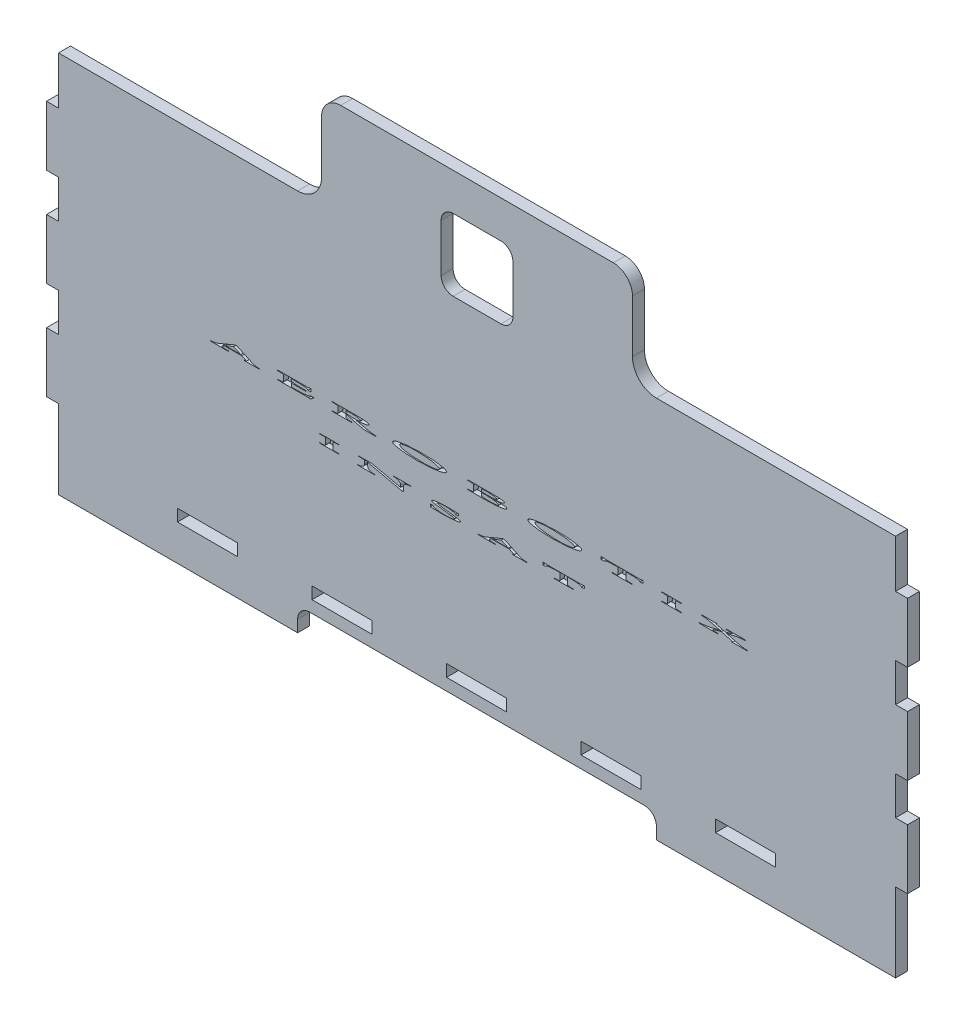
from build123d import *

# Parameters (mm, degrees)
SKETCH1_W           = 30
SKETCH1_H           = 30
BOSS_EXTRUDE1_DEPTH = 5
SKETCH3_W           = 5
SKETCH3_H           = 25
BOSS_EXTRUDE2_DEPTH = 5
SKETCH4_W           = 25
SKETCH4_H           = 5
CUT_EXTRUDE1_DEPTH  = 10
FILLET1_R           = 5
CUT_EXTRUDE3_DEPTH  = 2


with BuildPart() as part:
    # Sketch1 → Boss-Extrude1 (new body)
    with BuildSketch(Plane.XY):
        with BuildLine():
            Line((75, -100), (175, -100))
            Line((175, -100), (175, 60))
            Line((175, 60), (75, 60))
            ThreePointArc((75, 60), (67.928932188, 62.928932188), (65, 70))
            Line((65, 70), (65, 92))
            ThreePointArc((65, 92), (62.656854249, 97.656854249), (57, 100))
            Line((57, 100), (-57, 100))
            ThreePointArc((-57, 100), (-62.656854249, 97.656854249), (-65, 92))
            Line((-65, 92), (-65, 70))
            ThreePointArc((-65, 70), (-67.928932188, 62.928932188), (-75, 60))
            Line((-75, 60), (-175, 60))
            Line((-175, 60), (-175, -100))
            Line((-175, -100), (-75, -100))
            Line((-75, -100), (-75, -95))
            ThreePointArc((-75, -95), (-73.535533906, -91.464466094), (-70, -90))
            Line((-70, -90), (70, -90))
            ThreePointArc((70, -90), (73.535533906, -91.464466094), (75, -95))
            Line((75, -95), (75, -100))
        make_face()
        with Locations((0, 69.377459969)):
            Rectangle(SKETCH1_W, SKETCH1_H, mode=Mode.SUBTRACT)
    extrude(amount=BOSS_EXTRUDE1_DEPTH)

    # Sketch3 → Boss-Extrude2 (add)
    with BuildSketch(Plane(origin=(175, 0, 0), x_dir=(0, 0, -1), z_dir=(1, 0, 0))):
        with Locations((-2.5, 27.5)):
            Rectangle(SKETCH3_W, SKETCH3_H)
        with Locations((-2.5, -13.5)):
            Rectangle(SKETCH3_W, SKETCH3_H)
        with Locations((-2.5, -54.5)):
            Rectangle(SKETCH3_W, SKETCH3_H)
    boss_extrude2 = extrude(amount=BOSS_EXTRUDE2_DEPTH)

    # Mirror1: Boss-Extrude2 across plane
    add(boss_extrude2.mirror(Plane(origin=(0, 0, 0), x_dir=(0, 0, 1), z_dir=(1, 0, 0))))

    # Sketch4 → Cut-Extrude1 (cut)
    with BuildSketch(Plane.XY.offset(5)):
        with Locations((112.25, -82.5)):
            Rectangle(SKETCH4_W, SKETCH4_H)
        with Locations((56, -82.5)):
            Rectangle(SKETCH4_W, SKETCH4_H)
        with Locations((-0.25, -82.5)):
            Rectangle(SKETCH4_W, SKETCH4_H)
        with Locations((-56.5, -82.5)):
            Rectangle(SKETCH4_W, SKETCH4_H)
        with Locations((-112.75, -82.5)):
            Rectangle(SKETCH4_W, SKETCH4_H)
    extrude(amount=-CUT_EXTRUDE1_DEPTH, mode=Mode.SUBTRACT)

    # Fillet1
    fillet1_edges = [part.edges().sort_by_distance(p)[0] for p in [
        (15, 54.377459969, 2.5),
        (15, 84.377459969, 2.5),
        (-15, 84.377459969, 2.5),
        (-15, 54.377459969, 2.5),
    ]]
    fillet(fillet1_edges, radius=FILLET1_R)

    # Sketch8 → Cut-Extrude3 (cut)
    # profile 1 of 14: a face of its own
    with BuildSketch(Plane.XY.offset(5)):
        with BuildLine():
            Line((-101.233753363, -8.855606322), (-100.208566796, -8.855606322))
            Line((-100.208566796, -8.855606322), (-94.257424072, -11.643036359))
            add(Edge.make_bspline(
                [(-94.257424072, -11.643036359), (-94.151025404, -11.693210831), (-93.935566776, -11.794814763), (-93.597670993, -11.927011039), (-93.244379954, -12.046647392), (-92.937468984, -12.136021835), (-92.678397454, -12.198007207), (-92.468115228, -12.238476415), (-92.244081843, -12.273519333), (-92.00580894, -12.301727321), (-91.753759138, -12.324456581), (-91.487571937, -12.341287987), (-91.207541032, -12.353123146), (-91.016181827, -12.355305412), (-90.918221647, -12.356422553)],
                knots=[0, 0, 0, 0, 1.228262744, 2.487247351, 3.78658143, 5.12299962, 5.823926335, 6.567880966, 7.358785162, 8.191617613, 9.073234901, 10.001480062, 10.976922105, 12, 12, 12, 12], degree=3))
            Line((-90.918221647, -12.356422553), (-90.918221647, -12.564561545))
            Line((-90.918221647, -12.564561545), (-97.123212318, -12.564561545))
            Line((-97.123212318, -12.564561545), (-97.123212318, -12.355606322))
            Line((-97.123212318, -12.355606322), (-96.645716982, -12.355606322))
            add(Edge.make_bspline(
                [(-96.645716982, -12.355606322), (-96.625851938, -12.355477407), (-96.588825272, -12.355237122), (-96.537092222, -12.352814319), (-96.493459247, -12.349056823), (-96.457687729, -12.343530301), (-96.429623282, -12.336330001), (-96.409018812, -12.328334461), (-96.394974108, -12.317171075), (-96.392836858, -12.307669962), (-96.391869035, -12.303367516)],
                knots=[0, 0, 0, 0, 1.763047815, 3.286163448, 4.59579159, 5.647871167, 6.497218517, 7.156802195, 7.61816961, 8, 8, 8, 8], degree=3))
            add(Edge.make_bspline(
                [(-96.391869035, -12.303367516), (-96.394853831, -12.30144982), (-96.40686878, -12.293730363), (-96.419275127, -12.286650402), (-96.428599445, -12.281329269)],
                knots=[0, 0, 0, 0, 0.496847155, 2, 2, 2, 2], degree=3))
            Line((-96.428599445, -12.281329269), (-98.3883709, -11.363069008))
            Line((-98.3883709, -11.363069008), (-105.606304669, -11.363069008))
            add(Edge.make_bspline(
                [(-105.606304669, -11.363069008), (-105.651776794, -11.38339584), (-105.739925567, -11.422799878), (-105.867490385, -11.481375688), (-105.985669372, -11.538640577), (-106.09546568, -11.593332593), (-106.196584885, -11.646111809), (-106.288725469, -11.697505604), (-106.372125817, -11.746729625), (-106.447348189, -11.792546387), (-106.513075329, -11.837797814), (-106.570053698, -11.88106763), (-106.619306156, -11.921148059), (-106.658880924, -11.960116984), (-106.690955834, -11.996161103), (-106.711739816, -12.032082807), (-106.727928879, -12.064784039), (-106.72951293, -12.087181558), (-106.730255229, -12.097677217)],
                knots=[0, 0, 0, 0, 1.740650298, 3.374291104, 4.905229724, 6.329715775, 7.660898002, 8.891025645, 10.016211976, 11.045252476, 11.968331911, 12.803160704, 13.545775014, 14.184525234, 14.744541377, 15.222322611, 15.63557405, 16, 16, 16, 16], degree=3))
            add(Edge.make_bspline(
                [(-106.730255229, -12.097677217), (-106.728576989, -12.106265902), (-106.724701231, -12.126100772), (-106.696126757, -12.149048956), (-106.657899461, -12.172893984), (-106.602477202, -12.193753765), (-106.533084272, -12.215592299), (-106.448144982, -12.237693654), (-106.347394467, -12.257222701), (-106.232124044, -12.277813083), (-106.1031501, -12.296560106), (-105.961755367, -12.311383993), (-105.80887249, -12.325501924), (-105.643968517, -12.337040652), (-105.467033676, -12.344447359), (-105.278231531, -12.351623865), (-105.077665071, -12.354231869), (-104.939987601, -12.355139812), (-104.869247766, -12.355606322)],
                knots=[0, 0, 0, 0, 0.213743549, 0.493623318, 0.870507953, 1.35714368, 1.965770807, 2.699026562, 3.555578955, 4.539534124, 5.635892437, 6.823596244, 8.105004001, 9.486820711, 10.969266767, 12.5466266, 14.225627866, 16, 16, 16, 16], degree=3))
            Line((-104.869247766, -12.355606322), (-103.882424072, -12.355606322))
            Line((-103.882424072, -12.355606322), (-103.882424072, -12.564561545))
            Line((-103.882424072, -12.564561545), (-111.500311199, -12.564561545))
            Line((-111.500311199, -12.564561545), (-111.500311199, -12.357238784))
            add(Edge.make_bspline(
                [(-111.500311199, -12.357238784), (-111.343534142, -12.354059133), (-111.033450814, -12.347770223), (-110.574588882, -12.313278416), (-110.127382153, -12.261409708), (-109.692009312, -12.19068813), (-109.268565627, -12.10031282), (-108.857482465, -11.98940947), (-108.457309777, -11.862025775), (-108.198922682, -11.759359095), (-108.070507094, -11.708334866)],
                knots=[0, 0, 0, 0, 1.071416255, 2.119113114, 3.143081302, 4.147196698, 5.132171985, 6.100491633, 7.055964913, 8, 8, 8, 8], degree=3))
            Line((-108.070507094, -11.708334866), (-101.233753363, -8.855606322))
        make_face()
        Polygon((-101.818175005, -9.746930948), (-105.163907281, -11.101874978), (-98.762204855, -11.101874978), align=None, mode=Mode.SUBTRACT)
    # profile 2 of 14: a face of its own
    with BuildSketch(Plane.XY.offset(5)):
        with BuildLine():
            Line((-70.276873699, -8.855606322), (-69.346369967, -8.855606322))
            Line((-69.346369967, -8.855606322), (-69.346369967, -10.004860053))
            Line((-69.346369967, -10.004860053), (-70.64825896, -10.004860053))
            add(Edge.make_bspline(
                [(-70.64825896, -10.004860053), (-70.650889536, -9.988649768), (-70.656222281, -9.95578802), (-70.676491726, -9.908145145), (-70.708990337, -9.863669716), (-70.750709566, -9.820515129), (-70.803259817, -9.779315357), (-70.866500621, -9.740530638), (-70.940117354, -9.70335074), (-71.02401309, -9.667206805), (-71.118513803, -9.633519399), (-71.223578811, -9.600700449), (-71.339042283, -9.569959796), (-71.465436499, -9.541432186), (-71.602227784, -9.515116221), (-71.749521062, -9.488326207), (-71.907521448, -9.465362285), (-72.076196557, -9.443059625), (-72.255867152, -9.423079471), (-72.447092571, -9.403202442), (-72.65009724, -9.385395952), (-72.864819702, -9.369397486), (-73.091155211, -9.353537164), (-73.329003843, -9.340149415), (-73.578471962, -9.326755647), (-73.839681283, -9.315415369), (-74.112871851, -9.305930612), (-74.39772419, -9.296702943), (-74.694025208, -9.289408832), (-75.001757877, -9.283987996), (-75.321171036, -9.278823223), (-75.652567373, -9.275632107), (-75.995661291, -9.274189004), (-76.228288403, -9.273743107), (-76.346369967, -9.273516769)],
                knots=[0, 0, 0, 0, 0.267286915, 0.541848272, 0.834982773, 1.161512199, 1.518573077, 1.921385402, 2.370093735, 2.863246273, 3.41093149, 4.006273925, 4.658849746, 5.359950806, 6.120021218, 6.931641524, 7.802453301, 8.724790162, 9.707742576, 10.752010352, 11.861725667, 13.032657393, 14.26525896, 15.563757047, 16.919634033, 18.341599033, 19.829749862, 21.379867764, 22.991863021, 24.665803043, 26.401810464, 28.204291909, 30.073297881, 32, 32, 32, 32], degree=3))
            Line((-76.346369967, -9.273516769), (-77.635199258, -9.273516769))
            add(Edge.make_bspline(
                [(-77.635199258, -9.273516769), (-77.661648926, -9.312853072), (-77.71238646, -9.38831062), (-77.767303949, -9.507621206), (-77.802771951, -9.625184922), (-77.806995505, -9.703713048), (-77.809056535, -9.74203356)],
                knots=[0, 0, 0, 0, 1.118984084, 2.146510689, 3.095525868, 4, 4, 4, 4], degree=3))
            add(Edge.make_bspline(
                [(-77.809056535, -9.74203356), (-77.808292274, -9.759518667), (-77.806780156, -9.794113598), (-77.793884457, -9.845235491), (-77.772408916, -9.893972506), (-77.743132722, -9.941559952), (-77.705512296, -9.987143921), (-77.658777431, -10.030363964), (-77.605027733, -10.073279942), (-77.541699097, -10.112467092), (-77.471077813, -10.15136434), (-77.39197041, -10.187442913), (-77.304934257, -10.222868895), (-77.209249451, -10.256143801), (-77.105132306, -10.287603779), (-76.992997913, -10.317870697), (-76.872678767, -10.346406322), (-76.743395199, -10.373354871), (-76.604558913, -10.398434364), (-76.455255657, -10.422585107), (-76.295044042, -10.442879997), (-76.123985533, -10.46377043), (-75.942184192, -10.482278157), (-75.749263414, -10.499362743), (-75.545491284, -10.51509517), (-75.330736345, -10.527519251), (-75.105484944, -10.54011039), (-74.869304155, -10.550582181), (-74.62224936, -10.559525803), (-74.364039715, -10.566840661), (-74.095219919, -10.572499432), (-73.815246722, -10.576550564), (-73.524662767, -10.579034239), (-73.327130727, -10.579334373), (-73.226733773, -10.579486919)],
                knots=[0, 0, 0, 0, 0.3458045, 0.684186983, 1.036434695, 1.39674553, 1.787129244, 2.202470682, 2.655088539, 3.146733773, 3.674665809, 4.250673692, 4.866865891, 5.534696418, 6.255499268, 7.019928878, 7.833921242, 8.703398451, 9.634252317, 10.627014309, 11.697412593, 12.831275647, 14.038900198, 15.315203617, 16.665782564, 18.085125292, 19.574070972, 21.13242496, 22.765694877, 24.468607979, 26.246645645, 28.089121677, 30.012270452, 32, 32, 32, 32], degree=3))
            Line((-73.226733773, -10.579486919), (-71.488161012, -10.579486919))
            Line((-71.488161012, -10.579486919), (-71.488161012, -10.840680948))
            Line((-71.488161012, -10.840680948), (-77.600101311, -10.840680948))
            Line((-77.600101311, -10.840680948), (-77.600101311, -12.303367516))
            Line((-77.600101311, -12.303367516), (-75.9227459, -12.303367516))
            add(Edge.make_bspline(
                [(-75.9227459, -12.303367516), (-75.807112688, -12.303214572), (-75.578836479, -12.302912641), (-75.241184276, -12.300405727), (-74.912782324, -12.296364342), (-74.593902308, -12.29067868), (-74.284544056, -12.283370074), (-73.984437469, -12.274378785), (-73.693848899, -12.263863595), (-73.412514099, -12.251606954), (-73.140699565, -12.237763843), (-72.878131565, -12.222329154), (-72.624818139, -12.205183394), (-72.38101824, -12.186505867), (-72.146476383, -12.16608691), (-71.921442684, -12.144165443), (-71.705671871, -12.12047346), (-71.49940134, -12.095311571), (-71.302400838, -12.068345518), (-71.114888925, -12.039947853), (-70.936657589, -12.009706276), (-70.767897329, -11.97807849), (-70.608433318, -11.944559323), (-70.458413801, -11.909707972), (-70.317714091, -11.872908007), (-70.186417923, -11.834839715), (-70.06447735, -11.794753552), (-69.951877121, -11.753471555), (-69.848685122, -11.710090985), (-69.754745425, -11.665579219), (-69.670260165, -11.618912198), (-69.595021356, -11.571028437), (-69.528890573, -11.521369345), (-69.490537604, -11.485040135), (-69.472069594, -11.46754662)],
                knots=[0, 0, 0, 0, 1.686723522, 3.32982926, 4.925390259, 6.477420264, 7.982000647, 9.439186088, 10.856968995, 12.223516382, 13.546831267, 14.826991631, 16.060123908, 17.250285869, 18.393630397, 19.494234322, 20.548286867, 21.559890086, 22.525283994, 23.448605016, 24.326165607, 25.162150604, 25.952978241, 26.702904028, 27.408504963, 28.074143772, 28.696643228, 29.280535281, 29.823036002, 30.328954376, 30.796155681, 31.22991303, 31.629181929, 32, 32, 32, 32], degree=3))
            Line((-69.472069594, -11.46754662), (-68.197116236, -11.46754662))
            Line((-68.197116236, -11.46754662), (-69.608380229, -12.669039157))
            Line((-69.608380229, -12.669039157), (-70.488277617, -12.669039157))
            add(Edge.make_bspline(
                [(-70.488277617, -12.669039157), (-70.491946223, -12.660319631), (-70.500494255, -12.640002706), (-70.535850435, -12.619826261), (-70.584150336, -12.602757173), (-70.65027727, -12.588792196), (-70.733122197, -12.577797354), (-70.833431556, -12.570102207), (-70.951031551, -12.565331715), (-71.03514631, -12.564829578), (-71.080045341, -12.564561545)],
                knots=[0, 0, 0, 0, 0.358508681, 0.835342902, 1.499303573, 2.363942157, 3.439106323, 4.74034347, 6.260050653, 8, 8, 8, 8], degree=3))
            Line((-71.080045341, -12.564561545), (-83.346369967, -12.564561545))
            Line((-83.346369967, -12.564561545), (-83.346369967, -12.355606322))
            add(Edge.make_bspline(
                [(-83.346369967, -12.355606322), (-83.283791498, -12.355427399), (-83.161353455, -12.355077329), (-82.981516795, -12.352991656), (-82.809817531, -12.352092733), (-82.64631673, -12.348173653), (-82.491218169, -12.345299837), (-82.344565004, -12.341176963), (-82.206072778, -12.336300934), (-82.075742105, -12.330615183), (-81.953292781, -12.324212359), (-81.839320975, -12.316636703), (-81.733441845, -12.309537662), (-81.635753422, -12.301395002), (-81.546206218, -12.292587536), (-81.464848371, -12.282704872), (-81.391856309, -12.272409807), (-81.307847317, -12.257450999), (-81.215083265, -12.237065427), (-81.115714816, -12.208244392), (-81.031404079, -12.174628862), (-80.962262639, -12.136207406), (-80.907780568, -12.093701694), (-80.86793205, -12.046639014), (-80.842776632, -11.993823967), (-80.840200607, -11.956456621), (-80.838907281, -11.937695874)],
                knots=[0, 0, 0, 0, 1.697893965, 3.322018212, 4.87970662, 6.356417454, 7.759323045, 9.088609613, 10.336966788, 11.519229092, 12.628114502, 13.663738736, 14.618341601, 15.507261494, 16.323340106, 17.059515026, 17.730797208, 18.323068085, 19.374385874, 20.306312908, 21.12745087, 21.831578831, 22.446067536, 22.991442741, 23.493641112, 24, 24, 24, 24], degree=3))
            Line((-80.838907281, -11.937695874), (-80.838907281, -9.643269568))
            add(Edge.make_bspline(
                [(-80.838907281, -9.643269568), (-80.84036804, -9.625773993), (-80.843345739, -9.590109976), (-80.872597982, -9.541198791), (-80.916995324, -9.497967649), (-80.978481298, -9.459779496), (-81.056435968, -9.426260067), (-81.151295413, -9.397399193), (-81.262668904, -9.372616094), (-81.366696412, -9.355370344), (-81.459761105, -9.344327856), (-81.538003923, -9.334674621), (-81.623345344, -9.328374489), (-81.715158919, -9.31919751), (-81.814036427, -9.313547792), (-81.919551834, -9.306457157), (-82.031967512, -9.301310377), (-82.151087778, -9.2949328), (-82.277109157, -9.2914949), (-82.409877085, -9.287299617), (-82.549442266, -9.28304699), (-82.695824939, -9.279865556), (-82.84873462, -9.277366296), (-83.008722867, -9.276029425), (-83.175229607, -9.274079921), (-83.288689005, -9.273706573), (-83.346369967, -9.273516769)],
                knots=[0, 0, 0, 0, 0.475633837, 0.969560202, 1.517896808, 2.16527336, 2.939769924, 3.838288709, 4.878368931, 6.064966969, 6.726236119, 7.446733784, 8.225097126, 9.070962601, 9.975156168, 10.938878979, 11.9691844, 13.059068576, 14.207958453, 15.423922491, 16.699510954, 18.03453884, 19.43651954, 20.890593013, 22.419226703, 24, 24, 24, 24], degree=3))
            Line((-83.346369967, -9.273516769), (-83.346369967, -9.012322739))
            Line((-83.346369967, -9.012322739), (-71.331444594, -9.012322739))
            add(Edge.make_bspline(
                [(-71.331444594, -9.012322739), (-71.290089006, -9.012090741), (-71.210095597, -9.011641991), (-71.093898294, -9.010336707), (-70.985621102, -9.006755762), (-70.884907601, -9.003118945), (-70.791882582, -8.99705194), (-70.706364343, -8.991050119), (-70.628858864, -8.982585037), (-70.559068484, -8.974066117), (-70.497091519, -8.963166323), (-70.442398183, -8.952384468), (-70.395874608, -8.939196257), (-70.356792369, -8.925734876), (-70.325640717, -8.910147783), (-70.30117618, -8.894352353), (-70.284307949, -8.876016679), (-70.279227015, -8.862067233), (-70.276873699, -8.855606322)],
                knots=[0, 0, 0, 0, 1.818319585, 3.517144596, 5.108859181, 6.581445873, 7.947724491, 9.207413738, 10.350117524, 11.375398012, 12.297742506, 13.116531559, 13.824740232, 14.422619435, 14.930844211, 15.352252546, 15.699985287, 16, 16, 16, 16], degree=3))
        make_face()
    # profile 3 of 14: a face of its own
    with BuildSketch(Plane.XY.offset(5)):
        with BuildLine():
            Line((-60.575474445, -9.012322739), (-49.966915676, -9.012322739))
            add(Edge.make_bspline(
                [(-49.966915676, -9.012322739), (-49.869784098, -9.012553193), (-49.678784659, -9.013006356), (-49.396634033, -9.014389058), (-49.123741439, -9.017841474), (-48.859557691, -9.022058661), (-48.604313544, -9.026221723), (-48.358126363, -9.034470925), (-48.120836217, -9.041179846), (-47.892553981, -9.050201678), (-47.673001856, -9.060956195), (-47.462410571, -9.072373613), (-47.260762216, -9.08437444), (-47.068112309, -9.098192169), (-46.884483566, -9.113842149), (-46.709807149, -9.130180863), (-46.544023735, -9.146922782), (-46.387376856, -9.166110007), (-46.23969742, -9.184887392), (-46.101607127, -9.207445241), (-45.972884811, -9.230179136), (-45.853407012, -9.25318284), (-45.744190974, -9.279723829), (-45.644117984, -9.306336562), (-45.553385994, -9.334822118), (-45.472145031, -9.364662444), (-45.400342146, -9.395756034), (-45.338056037, -9.427978046), (-45.285324473, -9.462473971), (-45.241608665, -9.497722109), (-45.208206346, -9.535541092), (-45.18262894, -9.573679745), (-45.168111013, -9.615077499), (-45.166051378, -9.643169417), (-45.165026684, -9.657145501)],
                knots=[0, 0, 0, 0, 1.875496375, 3.687974199, 5.448012314, 7.145086625, 8.789725024, 10.376977521, 11.901217504, 13.373323969, 14.788156862, 16.145546324, 17.445544144, 18.68857569, 19.874813548, 21.003955375, 22.076101085, 23.091978871, 24.051179747, 24.950275601, 25.793257132, 26.575248192, 27.299007918, 27.962964308, 28.57440149, 29.134555491, 29.633303293, 30.084490486, 30.486647009, 30.848526872, 31.16482769, 31.457752846, 31.730225203, 32, 32, 32, 32], degree=3))
            add(Edge.make_bspline(
                [(-45.165026684, -9.657145501), (-45.166243495, -9.672512764), (-45.168694567, -9.703467655), (-45.18562341, -9.749394478), (-45.212862649, -9.793875098), (-45.250794175, -9.837985379), (-45.299268291, -9.880655152), (-45.358053085, -9.923465885), (-45.427355624, -9.965290288), (-45.507088725, -10.007268303), (-45.597961709, -10.047469252), (-45.698892218, -10.088208437), (-45.810475136, -10.128386716), (-45.932955396, -10.167023198), (-46.065902887, -10.206396217), (-46.209410516, -10.244474733), (-46.363507388, -10.281978247), (-46.527814739, -10.319476776), (-46.702287239, -10.3559711), (-46.886202319, -10.392030658), (-47.079518574, -10.426684067), (-47.282114584, -10.462149145), (-47.494118957, -10.496168161), (-47.715575942, -10.529799956), (-47.946141286, -10.561945799), (-48.186012173, -10.595105988), (-48.435283869, -10.626631502), (-48.694024296, -10.657744731), (-48.961820228, -10.687614237), (-49.238731989, -10.718149124), (-49.525249294, -10.74740191), (-49.821274161, -10.775969027), (-50.126590953, -10.803516903), (-50.333127942, -10.821676056), (-50.437881161, -10.830886172)],
                knots=[0, 0, 0, 0, 0.26667452, 0.537173122, 0.840254287, 1.16878814, 1.543547187, 1.959397962, 2.430244693, 2.948087929, 3.523349757, 4.155124089, 4.838199694, 5.582396266, 6.38531716, 7.246108154, 8.16066497, 9.139606291, 10.172929373, 11.256253994, 12.394426737, 13.583778708, 14.82827575, 16.123396837, 17.473940389, 18.871287263, 20.32891685, 21.837551947, 23.397271082, 25.008651157, 26.675922353, 28.399150692, 30.17369005, 32, 32, 32, 32], degree=3))
            Line((-50.437881161, -10.830886172), (-46.816262691, -11.687929083))
            add(Edge.make_bspline(
                [(-46.816262691, -11.687929083), (-46.61114903, -11.740090094), (-46.205241398, -11.843313606), (-45.597541807, -11.974140292), (-44.99963821, -12.089009728), (-44.410370804, -12.181224606), (-43.830235564, -12.256764115), (-43.258989554, -12.309630929), (-42.696938994, -12.346796957), (-42.325141757, -12.353778787), (-42.140889557, -12.357238784)],
                knots=[0, 0, 0, 0, 1.072704722, 2.122818299, 3.150379919, 4.158446268, 5.145637221, 6.11530857, 7.066000212, 8, 8, 8, 8], degree=3))
            Line((-42.140889557, -12.357238784), (-42.140889557, -12.564561545))
            Line((-42.140889557, -12.564561545), (-46.226943661, -12.564561545))
            add(Edge.make_bspline(
                [(-46.226943661, -12.564561545), (-46.32599311, -12.564108756), (-46.521168466, -12.563216543), (-46.809363182, -12.550958392), (-47.08919564, -12.533487048), (-47.36058211, -12.50821955), (-47.623589, -12.475859036), (-47.877698728, -12.43536579), (-48.123895701, -12.389997504), (-48.283995053, -12.35167036), (-48.363021087, -12.332751844)],
                knots=[0, 0, 0, 0, 1.103631764, 2.174688753, 3.21369797, 4.227643398, 5.211377611, 6.1658901, 7.094671962, 8, 8, 8, 8], degree=3))
            Line((-48.363021087, -12.332751844), (-54.829205788, -10.678250911))
            Line((-54.829205788, -10.678250911), (-54.829205788, -11.937695874))
            add(Edge.make_bspline(
                [(-54.829205788, -11.937695874), (-54.827158291, -11.953900469), (-54.822838389, -11.988089654), (-54.789293216, -12.034590458), (-54.738202788, -12.076023023), (-54.668379095, -12.114840883), (-54.579212143, -12.149834733), (-54.471164423, -12.183116071), (-54.343354902, -12.212494322), (-54.196358526, -12.240263294), (-54.029605971, -12.264120097), (-53.843435955, -12.285996531), (-53.637713038, -12.305559807), (-53.412366939, -12.321671158), (-53.16743317, -12.334387502), (-52.902952416, -12.344857936), (-52.618894865, -12.353281869), (-52.422961507, -12.355890946), (-52.321743102, -12.357238784)],
                knots=[0, 0, 0, 0, 0.295280276, 0.622995622, 1.015582258, 1.497910365, 2.079309123, 2.768402644, 3.567709338, 4.480959459, 5.508930417, 6.653556169, 7.91557518, 9.295168187, 10.79292977, 12.40951631, 14.145170185, 16, 16, 16, 16], degree=3))
            Line((-52.321743102, -12.357238784), (-52.321743102, -12.564561545))
            Line((-52.321743102, -12.564561545), (-60.575474445, -12.564561545))
            Line((-60.575474445, -12.564561545), (-60.575474445, -12.355606322))
            add(Edge.make_bspline(
                [(-60.575474445, -12.355606322), (-60.512895957, -12.355427854), (-60.390457876, -12.355078674), (-60.210893532, -12.352989797), (-60.039465415, -12.352112303), (-59.876240347, -12.34807822), (-59.721392421, -12.345634767), (-59.57477527, -12.340054251), (-59.43626492, -12.335541389), (-59.305655681, -12.329898862), (-59.183527204, -12.323012875), (-59.06943857, -12.317188203), (-58.96368747, -12.308314591), (-58.865869634, -12.301055538), (-58.77647348, -12.290529211), (-58.695284489, -12.281304195), (-58.622074158, -12.270600999), (-58.537774867, -12.255853059), (-58.444242987, -12.235881624), (-58.34536267, -12.205545073), (-58.260754762, -12.17283837), (-58.191830893, -12.134650847), (-58.136651584, -12.092909456), (-58.097064598, -12.045786577), (-58.071994697, -11.993267117), (-58.069336611, -11.956180645), (-58.068011758, -11.937695874)],
                knots=[0, 0, 0, 0, 1.698749845, 3.323692786, 4.874780932, 6.352236151, 7.755848924, 9.078649457, 10.335017084, 11.517875347, 12.627319727, 13.655644722, 14.618635105, 15.508003087, 16.317919186, 17.061797862, 17.726109331, 18.325952632, 19.385010292, 20.319540093, 21.131474259, 21.84239339, 22.452605231, 22.998255351, 23.500706871, 24, 24, 24, 24], degree=3))
            Line((-58.068011758, -11.937695874), (-58.068011758, -9.639188411))
            add(Edge.make_bspline(
                [(-58.068011758, -9.639188411), (-58.069527395, -9.619593913), (-58.072584395, -9.580072336), (-58.100010322, -9.524278106), (-58.14451917, -9.475430591), (-58.204885434, -9.432185528), (-58.28150374, -9.39385871), (-58.374946209, -9.361344858), (-58.484737884, -9.333030939), (-58.587389206, -9.314527536), (-58.678908095, -9.300371191), (-58.75694856, -9.292335323), (-58.841376133, -9.281578077), (-58.933216312, -9.274297259), (-59.031614406, -9.265433224), (-59.137272504, -9.259551568), (-59.249904692, -9.252970172), (-59.369575373, -9.245966423), (-59.496147786, -9.241743127), (-59.629712725, -9.236428052), (-59.770114308, -9.232477554), (-59.917863812, -9.229436968), (-60.072394033, -9.225915172), (-60.23401257, -9.223577417), (-60.402430143, -9.221892867), (-60.516977452, -9.221485829), (-60.575474445, -9.221277963)],
                knots=[0, 0, 0, 0, 0.529548783, 1.068085727, 1.648919719, 2.309213305, 3.072214866, 3.966963037, 4.989826803, 6.147190424, 6.796865992, 7.50317992, 8.276372094, 9.106842987, 10.003539839, 10.958104631, 11.979020109, 13.066300831, 14.211916667, 15.416574763, 16.694806466, 18.024531619, 19.428094888, 20.890599373, 22.412092026, 24, 24, 24, 24], degree=3))
            Line((-60.575474445, -9.221277963), (-60.575474445, -9.012322739))
        make_face()
        with BuildLine():
            Line((-54.829205788, -9.395135239), (-54.829205788, -10.417873113))
            add(Edge.make_bspline(
                [(-54.829205788, -10.417873113), (-54.67768828, -10.434742561), (-54.379422434, -10.467950474), (-53.938975453, -10.512255326), (-53.512604815, -10.549241445), (-53.10057335, -10.578178701), (-52.703076465, -10.602244068), (-52.319963793, -10.619629325), (-51.95095741, -10.629686765), (-51.709575281, -10.631054882), (-51.59121605, -10.631725725)],
                knots=[0, 0, 0, 0, 1.126928665, 2.21838608, 3.272119231, 4.290345843, 5.2715287, 6.215720262, 7.125096878, 8, 8, 8, 8], degree=3))
            add(Edge.make_bspline(
                [(-51.59121605, -10.631725725), (-51.473673278, -10.631320614), (-51.246181627, -10.630536565), (-50.916676558, -10.622707273), (-50.610472324, -10.612259458), (-50.328047115, -10.594665641), (-50.068865309, -10.574170216), (-49.833198802, -10.547904851), (-49.620576382, -10.518796013), (-49.431664854, -10.482710021), (-49.265313228, -10.443276438), (-49.121288187, -10.399541329), (-48.998967887, -10.3527584), (-48.898035954, -10.302877799), (-48.818574231, -10.248437605), (-48.760957597, -10.189514662), (-48.72446218, -10.124609194), (-48.71962909, -10.078723034), (-48.71726549, -10.056282628)],
                knots=[0, 0, 0, 0, 1.849334744, 3.579192581, 5.185597489, 6.669467468, 8.031026431, 9.275728108, 10.399940258, 11.406575418, 12.300527734, 13.088607014, 13.773060924, 14.358884723, 14.856522415, 15.280469388, 15.648117013, 16, 16, 16, 16], degree=3))
            add(Edge.make_bspline(
                [(-48.71726549, -10.056282628), (-48.718105097, -10.042335117), (-48.719815698, -10.01391871), (-48.732365871, -9.971769435), (-48.754635995, -9.931657085), (-48.783168552, -9.891630037), (-48.821935772, -9.854675384), (-48.866882935, -9.816511876), (-48.920915395, -9.780105505), (-48.983639501, -9.745421962), (-49.053725884, -9.709794637), (-49.132977223, -9.677194169), (-49.219938228, -9.644111575), (-49.315138841, -9.612802044), (-49.41850391, -9.581583639), (-49.530038348, -9.551360333), (-49.650322707, -9.52336549), (-49.823123381, -9.484393404), (-50.052063004, -9.440897668), (-50.339350176, -9.396463766), (-50.641695964, -9.357868051), (-50.959136891, -9.327480896), (-51.291399369, -9.302726081), (-51.638696861, -9.286201503), (-52.000890697, -9.275054853), (-52.247457186, -9.274036144), (-52.373165676, -9.273516769)],
                knots=[0, 0, 0, 0, 0.259147681, 0.527982826, 0.80850275, 1.108920642, 1.437903141, 1.800499774, 2.204465331, 2.646056001, 3.132299069, 3.664855629, 4.237803117, 4.861487073, 5.527026685, 6.244669157, 7.008840881, 7.822292545, 9.537120521, 11.338811876, 13.224967746, 15.201536372, 17.265352395, 19.417234228, 21.663540713, 24, 24, 24, 24], degree=3))
            add(Edge.make_bspline(
                [(-52.373165676, -9.273516769), (-52.484447463, -9.273770973), (-52.704577656, -9.274273823), (-53.030829917, -9.280064417), (-53.349439196, -9.290064254), (-53.660470838, -9.302832094), (-53.963881932, -9.319856737), (-54.259342038, -9.341381303), (-54.547039331, -9.365286718), (-54.735916482, -9.385266781), (-54.829205788, -9.395135239)],
                knots=[0, 0, 0, 0, 1.085552831, 2.147368051, 3.182969279, 4.195084729, 5.183993673, 6.147264317, 7.084905591, 8, 8, 8, 8], degree=3))
        make_face(mode=Mode.SUBTRACT)
    # profile 4 of 14: a face of its own
    with BuildSketch(Plane.XY.offset(5)):
        with BuildLine():
            add(Edge.make_bspline(
                [(-23.216076124, -8.960083933), (-22.986168412, -8.960478662), (-22.533139809, -8.961256465), (-21.863531307, -8.969663743), (-21.214048616, -8.983268705), (-20.584450869, -9.003106474), (-19.974669361, -9.027193718), (-19.384494346, -9.057378462), (-18.814164514, -9.093085408), (-18.263170695, -9.134797703), (-17.73006022, -9.181804637), (-17.213397026, -9.236024617), (-16.712000639, -9.29482674), (-16.226676335, -9.362232053), (-15.757145918, -9.43435516), (-15.303528226, -9.513695863), (-14.865591233, -9.599060121), (-14.512180131, -9.676132544), (-14.242104829, -9.740201541), (-14.054281894, -9.789910543), (-13.879598663, -9.841276911), (-13.71772779, -9.89371826), (-13.56821173, -9.945751098), (-13.432462908, -10.001845757), (-13.309250657, -10.05787621), (-13.19829304, -10.114162307), (-13.101712938, -10.174652383), (-13.01665897, -10.234120767), (-12.944249125, -10.295507775), (-12.88624486, -10.359612673), (-12.839261476, -10.423842635), (-12.807043725, -10.49054485), (-12.785934147, -10.558345386), (-12.783433422, -10.60464116), (-12.782190863, -10.627644568)],
                knots=[0, 0, 0, 0, 2.037963676, 4.015767159, 5.935978727, 7.796358804, 9.599407867, 11.345403867, 13.034571995, 14.664756049, 16.243443618, 17.778373817, 19.269633723, 20.718203971, 22.121488821, 23.480314401, 24.799963724, 26.076287867, 26.68641003, 27.260296202, 27.798316917, 28.300175021, 28.768544181, 29.201187512, 29.601585934, 29.968342471, 30.302988903, 30.610828295, 30.887857294, 31.142239661, 31.375783788, 31.590431864, 31.796494107, 32, 32, 32, 32], degree=3))
            add(Edge.make_bspline(
                [(-12.782190863, -10.627644568), (-12.783862039, -10.652585228), (-12.787259321, -10.703286317), (-12.812627483, -10.778184544), (-12.853309181, -10.851625073), (-12.911442703, -10.922754881), (-12.983511247, -10.994168728), (-13.072780034, -11.062980327), (-13.176999261, -11.131688268), (-13.297490594, -11.199152062), (-13.433975601, -11.265583254), (-13.586020968, -11.331977279), (-13.754587774, -11.395526788), (-13.938212003, -11.460576237), (-14.138560306, -11.522858102), (-14.354690819, -11.584720367), (-14.586828035, -11.645931956), (-14.920275752, -11.726754202), (-15.357383878, -11.822189293), (-15.898761017, -11.930276302), (-16.460293908, -12.028726943), (-17.041638871, -12.119009194), (-17.642984093, -12.202224314), (-18.264186129, -12.277464095), (-18.905137031, -12.342869567), (-19.563593986, -12.401739382), (-20.23605258, -12.451519189), (-20.918719887, -12.495668396), (-21.609539074, -12.533486501), (-22.308592065, -12.562914675), (-23.015424718, -12.588448754), (-23.730526314, -12.603570876), (-24.453716312, -12.615264394), (-24.938591297, -12.61628647), (-25.18237743, -12.616800351)],
                knots=[0, 0, 0, 0, 0.186290903, 0.378704951, 0.585445495, 0.811402217, 1.063212737, 1.342884236, 1.652731223, 1.996250347, 2.3748353, 2.787659914, 3.236617826, 3.721872881, 4.244466735, 4.805454489, 5.40317934, 6.039853654, 7.371436137, 8.749051992, 10.168548219, 11.634900278, 13.148918763, 14.708755261, 16.314635479, 17.967378945, 19.652937201, 21.357661387, 23.083764246, 24.827267727, 26.590550869, 28.373590491, 30.176708677, 32, 32, 32, 32], degree=3))
            add(Edge.make_bspline(
                [(-25.18237743, -12.616800351), (-25.355964677, -12.616575164), (-25.699884019, -12.616129013), (-26.21085083, -12.609885119), (-26.712320099, -12.601475383), (-27.203941556, -12.587685579), (-27.685866965, -12.573172529), (-28.157625034, -12.552155252), (-28.619899873, -12.528581661), (-29.072422747, -12.501993664), (-29.515082763, -12.470766787), (-29.947959001, -12.436346046), (-30.37119869, -12.399649999), (-30.784591852, -12.35615919), (-31.188271812, -12.312218616), (-31.582163609, -12.262650423), (-31.966217302, -12.211031659), (-32.338096351, -12.154670321), (-32.693611925, -12.096760735), (-33.028362261, -12.035697666), (-33.339937907, -11.972187151), (-33.628435732, -11.906981228), (-33.893999186, -11.840500703), (-34.136674006, -11.771443356), (-34.356143879, -11.699869133), (-34.552870142, -11.626916727), (-34.726203528, -11.551156223), (-34.877334705, -11.474222342), (-35.005333956, -11.394712055), (-35.110623859, -11.313097942), (-35.193262226, -11.229146316), (-35.25192307, -11.141834516), (-35.290403305, -11.052135501), (-35.294914062, -10.990124701), (-35.297116236, -10.959850725)],
                knots=[0, 0, 0, 0, 1.585532858, 3.141333397, 4.667459741, 6.166532027, 7.633530033, 9.071289146, 10.479728574, 11.861422255, 13.211679435, 14.5329376, 15.82778609, 17.09189421, 18.329613187, 19.536699972, 20.717961645, 21.869004224, 22.972108095, 24.00792643, 24.976841379, 25.876345173, 26.709329902, 27.477051923, 28.18041934, 28.817413013, 29.392729035, 29.907346932, 30.365181261, 30.766892357, 31.12192962, 31.435541246, 31.724428461, 32, 32, 32, 32], degree=3))
            add(Edge.make_bspline(
                [(-35.297116236, -10.959850725), (-35.296668873, -10.942355638), (-35.295778081, -10.907519307), (-35.282813527, -10.855964776), (-35.265711657, -10.804553227), (-35.238980921, -10.754376885), (-35.207985635, -10.703308428), (-35.166753387, -10.654767528), (-35.120480463, -10.60533939), (-35.065909571, -10.557366845), (-35.004820655, -10.509098095), (-34.935766983, -10.461952963), (-34.860090157, -10.414807425), (-34.777219865, -10.367855136), (-34.686577961, -10.322875395), (-34.589437673, -10.276779653), (-34.48483677, -10.231990692), (-34.372961121, -10.188385786), (-34.254355747, -10.14368642), (-34.127992871, -10.101193566), (-33.994904074, -10.057435112), (-33.854276082, -10.015408685), (-33.706666883, -9.972735065), (-33.551537938, -9.931166838), (-33.389199212, -9.890755467), (-33.220106386, -9.849592636), (-33.043758354, -9.809696153), (-32.859999288, -9.770696606), (-32.668974367, -9.731636855), (-32.471088305, -9.691973637), (-32.265364497, -9.655220163), (-32.05314895, -9.616086383), (-31.833100274, -9.579984362), (-31.529393472, -9.530537289), (-31.14128616, -9.471434824), (-30.668135458, -9.405106691), (-30.186974763, -9.344383579), (-29.698095804, -9.286902834), (-29.201193526, -9.234957101), (-28.696505282, -9.186654389), (-28.18360869, -9.143372531), (-27.663054742, -9.105386115), (-27.134699096, -9.070722929), (-26.598373165, -9.041777237), (-26.053954998, -9.016105555), (-25.50159066, -8.996137366), (-24.941382318, -8.97950224), (-24.373258976, -8.968201881), (-23.797248339, -8.961689811), (-23.410612887, -8.960621471), (-23.216076124, -8.960083933)],
                knots=[0, 0, 0, 0, 0.200478866, 0.399194815, 0.607820796, 0.821743928, 1.050739407, 1.292928096, 1.551663362, 1.828432057, 2.126768198, 2.445904275, 2.788567725, 3.151147175, 3.53983832, 3.951014016, 4.386569638, 4.846955266, 5.330696588, 5.842831935, 6.378694177, 6.940469446, 7.529234501, 8.144274184, 8.785761759, 9.451534334, 10.143990899, 10.863255833, 11.610062055, 12.384452428, 13.182243618, 14.011353998, 14.864037081, 15.744484208, 17.547159982, 19.374962805, 21.234371773, 23.11981861, 25.031160836, 26.975162168, 28.945509711, 30.945546479, 32.972573093, 35.029687321, 37.117235124, 39.23523838, 41.380847731, 43.557249778, 45.764617182, 48, 48, 48, 48], degree=3))
        make_face()
        with BuildLine():
            add(Edge.make_bspline(
                [(-25.29746605, -9.325755575), (-25.423709897, -9.326219478), (-25.673480467, -9.327137298), (-26.043798633, -9.329895339), (-26.405660494, -9.336848462), (-26.758853071, -9.345272485), (-27.103813148, -9.35823764), (-27.440167927, -9.371321021), (-27.768275443, -9.38890119), (-28.087716884, -9.408296228), (-28.398721972, -9.430282988), (-28.701272981, -9.454917137), (-28.995213714, -9.481332468), (-29.280846309, -9.511964516), (-29.557870466, -9.544349557), (-29.826701883, -9.579492107), (-30.086841458, -9.616961392), (-30.337523947, -9.656561461), (-30.575799555, -9.698989033), (-30.800254656, -9.741692305), (-31.008565358, -9.78759309), (-31.201917625, -9.83388824), (-31.379731643, -9.881816694), (-31.542374711, -9.931304998), (-31.689322927, -9.982746934), (-31.821202188, -10.034524762), (-31.93749819, -10.08817157), (-32.038412693, -10.14341835), (-32.124116348, -10.200276482), (-32.194325404, -10.25930959), (-32.250205083, -10.319277576), (-32.289456176, -10.381853531), (-32.315544142, -10.445808501), (-32.318199393, -10.490014838), (-32.319504296, -10.511739717)],
                knots=[0, 0, 0, 0, 1.656506828, 3.277360928, 4.859139709, 6.405459118, 7.912960946, 9.388629677, 10.822171287, 12.224241374, 13.587831907, 14.913075839, 16.207228242, 17.460149235, 18.682328809, 19.866856319, 21.017473659, 22.130869285, 23.196747363, 24.19306571, 25.128602914, 25.995354613, 26.801619212, 27.544681917, 28.225509113, 28.844030695, 29.403055975, 29.904806398, 30.352357083, 30.750042446, 31.10641961, 31.422402087, 31.71614375, 32, 32, 32, 32], degree=3))
            add(Edge.make_bspline(
                [(-32.319504296, -10.511739717), (-32.317355328, -10.544442889), (-32.313004385, -10.610655895), (-32.274558785, -10.707215777), (-32.214354773, -10.800100919), (-32.131145105, -10.890598058), (-32.023880281, -10.976510009), (-31.894823115, -11.061796675), (-31.741726867, -11.143017925), (-31.56583158, -11.223131746), (-31.36693163, -11.301031941), (-31.144413119, -11.375588889), (-30.898705294, -11.4479958), (-30.630134108, -11.518851969), (-30.337575718, -11.58607895), (-30.022313567, -11.652398151), (-29.68300239, -11.714549137), (-29.323831004, -11.775264556), (-28.950447629, -11.832584472), (-28.569174362, -11.886226758), (-28.183403338, -11.936991122), (-27.792682569, -11.983616334), (-27.39726571, -12.025712675), (-26.997030466, -12.064946102), (-26.592197414, -12.101023051), (-26.182422658, -12.132851885), (-25.767720995, -12.160312152), (-25.348461863, -12.185023734), (-24.924270039, -12.205441253), (-24.495438601, -12.221495716), (-24.061736012, -12.234574883), (-23.623413404, -12.244504505), (-23.180178392, -12.250362599), (-22.88305546, -12.250872412), (-22.7336834, -12.25112871)],
                knots=[0, 0, 0, 0, 0.312369377, 0.632443715, 0.981748967, 1.369303426, 1.804574311, 2.29552354, 2.849589726, 3.46319839, 4.146762526, 4.895322607, 5.711105362, 6.600801641, 7.556313408, 8.587073901, 9.687432875, 10.861326686, 12.077311419, 13.306866319, 14.550512865, 15.80547477, 17.07710338, 18.360634762, 19.658771404, 20.971415521, 22.298720898, 23.640985657, 24.995573654, 26.367832552, 27.75276371, 29.153057924, 30.568762104, 32, 32, 32, 32], degree=3))
            add(Edge.make_bspline(
                [(-22.7336834, -12.25112871), (-22.61478531, -12.250675685), (-22.379433965, -12.249778951), (-22.02952514, -12.246853088), (-21.686141027, -12.240436284), (-21.349332283, -12.230092431), (-21.018977972, -12.219299775), (-20.695215876, -12.204277944), (-20.377413265, -12.1872436), (-20.066145274, -12.167645699), (-19.761358344, -12.145900138), (-19.46345627, -12.120357485), (-19.171773598, -12.092632726), (-18.886599896, -12.062602363), (-18.607728256, -12.029754273), (-18.33552576, -11.995148617), (-18.069774761, -11.956384387), (-17.812078418, -11.915974502), (-17.565455722, -11.874064205), (-17.333279105, -11.830194719), (-17.117434933, -11.784032084), (-16.916685675, -11.739368053), (-16.732837336, -11.690444413), (-16.563987478, -11.643541569), (-16.412304344, -11.592122005), (-16.275600262, -11.542427073), (-16.155179404, -11.490481118), (-16.051159786, -11.43647019), (-15.962112907, -11.382525375), (-15.889628092, -11.325973169), (-15.832057233, -11.269068048), (-15.790547215, -11.21031732), (-15.764889578, -11.149028779), (-15.76147711, -11.106991784), (-15.759802803, -11.086366583)],
                knots=[0, 0, 0, 0, 1.575260304, 3.118129394, 4.635972335, 6.125332182, 7.58249579, 9.015022691, 10.419283788, 11.798985351, 13.147047766, 14.467491644, 15.760184268, 17.028851315, 18.266473967, 19.480372664, 20.664079624, 21.824449699, 22.936187224, 23.97825686, 24.9545921, 25.860514175, 26.702474417, 27.474893681, 28.181631014, 28.823759461, 29.40168934, 29.917611673, 30.375746112, 30.778841837, 31.133146921, 31.444111682, 31.727256701, 32, 32, 32, 32], degree=3))
            add(Edge.make_bspline(
                [(-15.759802803, -11.086366583), (-15.761051625, -11.066958676), (-15.763570072, -11.02781955), (-15.779746565, -10.969325034), (-15.807641886, -10.912137938), (-15.844681749, -10.854169783), (-15.893415267, -10.797591985), (-15.952013286, -10.740608946), (-16.02178721, -10.685029456), (-16.101137572, -10.628114811), (-16.192231173, -10.573193379), (-16.293390888, -10.517914133), (-16.404925332, -10.462168894), (-16.527154931, -10.406857573), (-16.660490248, -10.352415049), (-16.804022846, -10.298015522), (-16.957810601, -10.24286424), (-17.122149477, -10.189680599), (-17.295661364, -10.1365456), (-17.477755924, -10.085233819), (-17.66774588, -10.035632567), (-17.865798181, -9.987262507), (-18.07185871, -9.941044817), (-18.285733909, -9.896156235), (-18.507486003, -9.852836601), (-18.737082049, -9.8111097), (-18.975338296, -9.772427102), (-19.221147775, -9.733533055), (-19.475201689, -9.698419894), (-19.736763748, -9.662437427), (-20.006589691, -9.630738476), (-20.284243333, -9.598167161), (-20.570015622, -9.569213071), (-20.959834606, -9.53246408), (-21.447900264, -9.490927909), (-22.027943851, -9.446349162), (-22.597778132, -9.410224063), (-23.157131, -9.378569068), (-23.706502147, -9.35479155), (-24.24582358, -9.339100003), (-24.775027014, -9.327409273), (-25.124418716, -9.326303329), (-25.29746605, -9.325755575)],
                knots=[0, 0, 0, 0, 0.234058133, 0.472015412, 0.725903311, 0.998910909, 1.299250624, 1.624055241, 1.983226835, 2.37375267, 2.80080946, 3.264768715, 3.763605831, 4.303914222, 4.882078943, 5.499903017, 6.154669368, 6.851844378, 7.58244395, 8.342672018, 9.132834268, 9.950015228, 10.800833521, 11.679108514, 12.58501792, 13.525179578, 14.492759903, 15.495454107, 16.525908553, 17.585164214, 18.678972143, 19.801719989, 20.956018541, 22.142321621, 24.522963878, 26.862250399, 29.156924115, 31.407650189, 33.617601649, 35.787128407, 37.913441576, 40, 40, 40, 40], degree=3))
        make_face(mode=Mode.SUBTRACT)
    # profile 5 of 14: a face of its own
    with BuildSketch(Plane.XY.offset(5)):
        with BuildLine():
            Line((-3.959056535, -9.012322739), (6.13690895, -9.012322739))
            add(Edge.make_bspline(
                [(6.13690895, -9.012322739), (6.270227331, -9.012449617), (6.530880719, -9.012697678), (6.913147741, -9.015503499), (7.278011251, -9.018418272), (7.625730475, -9.02336706), (7.956313145, -9.029751446), (8.269466916, -9.038116835), (8.565229924, -9.04693007), (8.84361594, -9.056989808), (9.104729417, -9.071003871), (9.348631897, -9.082907749), (9.574937931, -9.099090768), (9.783966892, -9.114917595), (9.975810884, -9.132852996), (10.150553771, -9.152171269), (10.307805572, -9.173443837), (10.449411398, -9.195305968), (10.57784436, -9.219973171), (10.697051903, -9.242780336), (10.807660753, -9.268578796), (10.910327767, -9.294431305), (11.00487975, -9.321086732), (11.091090365, -9.349116692), (11.169218155, -9.37709111), (11.239038785, -9.406923246), (11.301302261, -9.436240635), (11.354286537, -9.46850817), (11.400187573, -9.500253372), (11.437530145, -9.533324559), (11.467376965, -9.567263535), (11.487774777, -9.602546077), (11.501344603, -9.638773173), (11.502869702, -9.663560981), (11.503630033, -9.675918822)],
                knots=[0, 0, 0, 0, 2.311829085, 4.51990253, 6.628936863, 8.639007918, 10.550174193, 12.36250376, 14.07121124, 15.681220914, 17.192869728, 18.60557264, 19.915531817, 21.127022386, 22.24060238, 23.256585875, 24.175387032, 24.992161419, 25.740780218, 26.443066553, 27.096574629, 27.709915762, 28.278920132, 28.799635278, 29.281727125, 29.717243032, 30.116047353, 30.473683617, 30.791790785, 31.082513548, 31.33684879, 31.571519338, 31.78638307, 32, 32, 32, 32], degree=3))
            add(Edge.make_bspline(
                [(11.503630033, -9.675918822), (11.502575518, -9.688818543), (11.500408655, -9.715325452), (11.485621709, -9.754423979), (11.46128016, -9.792539801), (11.426504854, -9.829026304), (11.384462342, -9.867074329), (11.330949427, -9.902122739), (11.269974882, -9.939379414), (11.198551556, -9.974955074), (11.117631267, -10.009639079), (11.027543302, -10.044816712), (10.92823051, -10.079819613), (10.819191664, -10.113859582), (10.700940354, -10.148367448), (10.572813463, -10.181273401), (10.435549496, -10.215107897), (10.288802491, -10.247464963), (10.133133697, -10.279184773), (9.969047891, -10.310172397), (9.796788082, -10.340240724), (9.61620638, -10.369960017), (9.426979973, -10.397190148), (9.229533247, -10.424556986), (9.023677211, -10.449142575), (8.80995888, -10.475103617), (8.587580513, -10.4983101), (8.356909244, -10.52148228), (8.117686809, -10.542337339), (7.870104368, -10.562880944), (7.614332054, -10.582261572), (7.350182156, -10.601375613), (7.077789228, -10.618213808), (6.893287258, -10.628802659), (6.799688801, -10.634174419)],
                knots=[0, 0, 0, 0, 0.25193499, 0.517686985, 0.806825521, 1.130518309, 1.499669127, 1.912631975, 2.377694166, 2.896083881, 3.469993202, 4.097981937, 4.785789935, 5.527396574, 6.330077513, 7.192868789, 8.112369818, 9.092807003, 10.12934098, 11.217023382, 12.35606435, 13.546646831, 14.793406324, 16.092069304, 17.442095854, 18.844911286, 20.299377638, 21.811483136, 23.375534891, 24.992111124, 26.666571411, 28.388365057, 30.16780572, 32, 32, 32, 32], degree=3))
            add(Edge.make_bspline(
                [(6.799688801, -10.634174419), (6.913417853, -10.634283729), (7.137069565, -10.634498691), (7.467365078, -10.637605096), (7.787337441, -10.639487587), (8.096970033, -10.643489411), (8.396234504, -10.649805564), (8.684937316, -10.65480542), (8.963528413, -10.662641914), (9.231555811, -10.670232653), (9.489170932, -10.680715657), (9.736535542, -10.689938299), (9.973534982, -10.701233404), (10.20011452, -10.714882455), (10.416216623, -10.727353546), (10.621933262, -10.741943904), (10.817199553, -10.758827111), (11.002049145, -10.77453326), (11.176264674, -10.792274911), (11.339216757, -10.81284449), (11.491185014, -10.83443118), (11.631580662, -10.858996709), (11.760843142, -10.885180785), (11.879012659, -10.912136644), (11.985784688, -10.942984896), (12.081862163, -10.973802653), (12.166309861, -11.008213856), (12.239444984, -11.044150921), (12.3021938, -11.081148245), (12.353206811, -11.121233969), (12.393816468, -11.16301996), (12.421874075, -11.207900491), (12.44062143, -11.254449863), (12.442834826, -11.286721424), (12.44392854, -11.302667889)],
                knots=[0, 0, 0, 0, 1.874486861, 3.686236631, 5.444175064, 7.148396659, 8.789989229, 10.377779105, 11.907493892, 13.383544664, 14.79715703, 16.156997079, 17.463468418, 18.707719231, 19.898250769, 21.031200118, 22.106719126, 23.128622553, 24.088882366, 24.99274319, 25.835584787, 26.61854709, 27.341468863, 28.009344247, 28.615469341, 29.172781903, 29.671600208, 30.116822863, 30.515203676, 30.869585222, 31.183653723, 31.469813613, 31.738017055, 32, 32, 32, 32], degree=3))
            add(Edge.make_bspline(
                [(12.44392854, -11.302667889), (12.441664046, -11.324491283), (12.436983291, -11.369600694), (12.403470289, -11.434879564), (12.350160144, -11.496713227), (12.277835559, -11.558474892), (12.184402845, -11.616924563), (12.071693352, -11.675799904), (11.938821, -11.733255035), (11.784889131, -11.788074459), (11.611388193, -11.843733597), (11.416967045, -11.89675443), (11.202662688, -11.950232554), (10.967560301, -12.00090112), (10.712133047, -12.051741654), (10.436321707, -12.10013415), (10.140297555, -12.148409545), (9.826303948, -12.195291756), (9.498952092, -12.239786601), (9.163404654, -12.281232637), (8.822193622, -12.320264144), (8.475394829, -12.357650455), (8.122591242, -12.389238119), (7.764139548, -12.42132239), (7.3997024, -12.447440243), (7.029411805, -12.472109255), (6.653411525, -12.494334974), (6.271371665, -12.51275398), (5.883673427, -12.52934764), (5.490231272, -12.542376022), (5.091069912, -12.551870078), (4.685946875, -12.559521883), (4.275092834, -12.563395307), (3.999199693, -12.564171274), (3.860439734, -12.564561545)],
                knots=[0, 0, 0, 0, 0.236435819, 0.488717774, 0.780242354, 1.119455361, 1.516737965, 1.973788492, 2.498833465, 3.086449261, 3.746745549, 4.476117696, 5.273296351, 6.143912317, 7.08620512, 8.099971757, 9.183114657, 10.34166485, 11.545739265, 12.768789155, 14.011314449, 15.273415403, 16.55462964, 17.85590657, 19.179553216, 20.520256691, 21.883987891, 23.267726137, 24.671711227, 26.095909452, 27.540430398, 29.005429696, 30.493886254, 32, 32, 32, 32], degree=3))
            Line((3.860439734, -12.564561545), (-3.959056535, -12.564561545))
            Line((-3.959056535, -12.564561545), (-3.959056535, -12.355606322))
            add(Edge.make_bspline(
                [(-3.959056535, -12.355606322), (-3.897838441, -12.355426679), (-3.77784904, -12.355074573), (-3.601549495, -12.352991811), (-3.433114734, -12.352095097), (-3.272607353, -12.348165359), (-3.119957196, -12.345294233), (-2.974937108, -12.341158064), (-2.837803386, -12.336328557), (-2.708563505, -12.330587), (-2.587200122, -12.324227983), (-2.473506374, -12.316564542), (-2.367620358, -12.309574314), (-2.269659329, -12.301414509), (-2.17958694, -12.29245498), (-2.09738494, -12.282801084), (-2.022804682, -12.272228049), (-1.936318905, -12.257509586), (-1.840308059, -12.237096178), (-1.737666758, -12.208345953), (-1.650694401, -12.174598608), (-1.579231979, -12.136108191), (-1.522381179, -12.094193376), (-1.48135521, -12.046865341), (-1.456500769, -11.99374505), (-1.453235076, -11.956442753), (-1.451593848, -11.937695874)],
                knots=[0, 0, 0, 0, 1.662411853, 3.25837988, 4.787855064, 6.236287735, 7.618239098, 8.933897345, 10.175943967, 11.344460095, 12.446920928, 13.476062376, 14.438856542, 15.328540625, 16.145320806, 16.896800184, 17.57597281, 18.190590232, 19.278897837, 20.239989549, 21.082399514, 21.806502776, 22.438979503, 22.989553449, 23.492183551, 24, 24, 24, 24], degree=3))
            Line((-1.451593848, -11.937695874), (-1.451593848, -9.639188411))
            add(Edge.make_bspline(
                [(-1.451593848, -9.639188411), (-1.453109485, -9.619593913), (-1.456166484, -9.580072336), (-1.483592412, -9.524278106), (-1.52810126, -9.475430591), (-1.588467523, -9.432185528), (-1.66508583, -9.39385871), (-1.758528299, -9.361344858), (-1.868319974, -9.333030939), (-1.970971296, -9.314527536), (-2.062490185, -9.300371191), (-2.14053065, -9.292335323), (-2.224958222, -9.281578077), (-2.316798402, -9.274297259), (-2.415196496, -9.265433224), (-2.520854594, -9.259551568), (-2.633486781, -9.252970172), (-2.753157463, -9.245966423), (-2.879729876, -9.241743127), (-3.013294815, -9.236428052), (-3.153696397, -9.232477554), (-3.301445901, -9.229436968), (-3.455976123, -9.225915172), (-3.617594659, -9.223577417), (-3.786012233, -9.221892867), (-3.900559542, -9.221485829), (-3.959056535, -9.221277963)],
                knots=[0, 0, 0, 0, 0.529548783, 1.068085727, 1.648919719, 2.309213305, 3.072214866, 3.966963037, 4.989826803, 6.147190424, 6.796865992, 7.50317992, 8.276372094, 9.106842987, 10.003539839, 10.958104631, 11.979020109, 13.066300831, 14.211916667, 15.416574763, 16.694806466, 18.024531619, 19.428094888, 20.890599373, 22.412092026, 24, 24, 24, 24], degree=3))
            Line((-3.959056535, -9.221277963), (-3.959056535, -9.012322739))
        make_face()
        with BuildLine():
            Line((1.787212122, -9.384524232), (1.787212122, -10.475009307))
            Line((1.787212122, -10.475009307), (4.919091786, -10.475009307))
            add(Edge.make_bspline(
                [(4.919091786, -10.475009307), (5.044521331, -10.474764478), (5.289408688, -10.474286478), (5.64749458, -10.468581815), (5.987329613, -10.458623579), (6.30843884, -10.445999692), (6.611313393, -10.428942683), (6.895646814, -10.407636226), (7.16186994, -10.383691396), (7.371521512, -10.359350535), (7.528454368, -10.338615798), (7.636474012, -10.322216915), (7.736932285, -10.305285012), (7.829872266, -10.28697709), (7.91588542, -10.269742724), (7.994036717, -10.249667982), (8.06525238, -10.230444906), (8.128835135, -10.210333077), (8.184865415, -10.188835173), (8.233723269, -10.167398478), (8.274974558, -10.144431006), (8.30897406, -10.120955679), (8.33522434, -10.096383704), (8.355420994, -10.07172972), (8.36631475, -10.044849737), (8.368327602, -10.026701947), (8.369301674, -10.017919754)],
                knots=[0, 0, 0, 0, 2.540974308, 4.960972185, 7.254844317, 9.428292478, 11.470949089, 13.399906022, 15.204352619, 16.885539948, 17.675193957, 18.41105845, 19.098822653, 19.738764054, 20.330072465, 20.875492345, 21.372932461, 21.824397534, 22.225664304, 22.58831545, 22.904177053, 23.180978147, 23.422745578, 23.631104152, 23.821481592, 24, 24, 24, 24], degree=3))
            add(Edge.make_bspline(
                [(8.369301674, -10.017919754), (8.36820675, -10.005036106), (8.365986358, -9.978909408), (8.35225154, -9.940209402), (8.328499596, -9.903263334), (8.296060715, -9.867173975), (8.254694436, -9.832115366), (8.204160207, -9.797781413), (8.144770125, -9.764068263), (8.076668008, -9.730082434), (7.998683491, -9.699105188), (7.912328944, -9.66693856), (7.81650254, -9.636475818), (7.712286519, -9.604938575), (7.598432201, -9.576351644), (7.476245657, -9.546348725), (7.344272271, -9.519224237), (7.153924978, -9.481499756), (6.901395381, -9.438302516), (6.583646293, -9.394672314), (6.248050703, -9.357326013), (5.894278568, -9.326204196), (5.522478559, -9.303051644), (5.132525805, -9.286075468), (4.724892133, -9.275079502), (4.447045237, -9.274044722), (4.305285816, -9.273516769)],
                knots=[0, 0, 0, 0, 0.218495975, 0.44308711, 0.687492701, 0.958627311, 1.2627368, 1.604262652, 1.992636741, 2.419536273, 2.893100786, 3.413947041, 3.981227448, 4.596952154, 5.259089377, 5.970445785, 6.729260143, 7.54229788, 9.2594459, 11.070492196, 12.977622218, 14.982044298, 17.089102801, 19.290883789, 21.597376114, 24, 24, 24, 24], degree=3))
            add(Edge.make_bspline(
                [(4.305285816, -9.273516769), (4.173327321, -9.273834052), (3.917018893, -9.274450324), (3.543969083, -9.279084797), (3.194061847, -9.288167652), (2.867534974, -9.300182364), (2.564405648, -9.315631856), (2.284618207, -9.333969934), (2.027964073, -9.356482798), (1.864988873, -9.375465233), (1.787212122, -9.384524232)],
                knots=[0, 0, 0, 0, 1.255774602, 2.439142794, 3.550276381, 4.586685927, 5.548539482, 6.438630835, 7.254866863, 8, 8, 8, 8], degree=3))
        make_face(mode=Mode.SUBTRACT)
        with BuildLine():
            Line((1.787212122, -10.736203336), (1.787212122, -12.09359606))
            add(Edge.make_bspline(
                [(1.787212122, -12.09359606), (1.923190518, -12.110451101), (2.197324252, -12.144431021), (2.612964154, -12.186034215), (3.03572416, -12.223416864), (3.466269588, -12.252360556), (3.904362913, -12.275266808), (4.350081343, -12.291420466), (4.803139629, -12.301525988), (5.107635928, -12.302750433), (5.261092719, -12.303367516)],
                knots=[0, 0, 0, 0, 0.944228429, 1.903573452, 2.878484139, 3.868914639, 4.877160154, 5.90159951, 6.942470542, 8, 8, 8, 8], degree=3))
            add(Edge.make_bspline(
                [(5.261092719, -12.303367516), (5.405570779, -12.302717861), (5.687209321, -12.301451457), (6.098093126, -12.292306571), (6.486708886, -12.278099739), (6.852447226, -12.256924378), (7.195891644, -12.230104751), (7.516603664, -12.198072609), (7.814629772, -12.158904874), (8.048207354, -12.12118964), (8.222087736, -12.088051826), (8.341825081, -12.06271174), (8.453032233, -12.036505607), (8.556509657, -12.011025819), (8.651117299, -11.982499278), (8.738516124, -11.955859056), (8.816794114, -11.925821477), (8.887212904, -11.897126881), (8.948968615, -11.866563825), (9.002884873, -11.83584175), (9.049089044, -11.804501571), (9.085900606, -11.771207195), (9.116634419, -11.738954442), (9.137176356, -11.703960409), (9.150384312, -11.66844907), (9.152064811, -11.644228631), (9.152883764, -11.632425351)],
                knots=[0, 0, 0, 0, 2.561882004, 4.994008894, 7.287291051, 9.457120164, 11.489655017, 13.395478944, 15.171582963, 16.818950035, 17.590100693, 18.3101805, 18.988927765, 19.616112721, 20.19929875, 20.740954933, 21.235601451, 21.685393878, 22.088867451, 22.456290399, 22.785524945, 23.07599829, 23.335626308, 23.571435296, 23.791148753, 24, 24, 24, 24], degree=3))
            add(Edge.make_bspline(
                [(9.152883764, -11.632425351), (9.151733162, -11.61758145), (9.149377928, -11.587196605), (9.130831654, -11.542560265), (9.100093245, -11.500212505), (9.059920907, -11.457023924), (9.006292669, -11.416925893), (8.942498698, -11.375693357), (8.866187368, -11.336750273), (8.779585995, -11.295949778), (8.680531938, -11.258777787), (8.570874051, -11.219787666), (8.449274898, -11.182757881), (8.315932961, -11.145936596), (8.171049962, -11.110382556), (8.014505997, -11.075349106), (7.846669052, -11.040250574), (7.667388281, -11.005979144), (7.477146847, -10.973502503), (7.276385512, -10.942346423), (7.06519484, -10.913930021), (6.843637886, -10.888092528), (6.611865073, -10.863315366), (6.369628648, -10.841754955), (6.117173801, -10.82104361), (5.854317258, -10.803203461), (5.580839159, -10.78790965), (5.29705029, -10.774182268), (5.002962968, -10.761397562), (4.698457449, -10.75305903), (4.383663409, -10.745630545), (4.058530211, -10.739787424), (3.723047898, -10.736489852), (3.495857115, -10.736299826), (3.380495704, -10.736203336)],
                knots=[0, 0, 0, 0, 0.237876282, 0.486922799, 0.763215103, 1.075345932, 1.430142259, 1.834889267, 2.294108354, 2.804258732, 3.371331439, 3.991683037, 4.672913075, 5.411626937, 6.212636401, 7.067916175, 7.987237039, 8.965678556, 9.998444627, 11.085857567, 12.227600203, 13.419706245, 14.667281497, 15.970095661, 17.324393057, 18.73435034, 20.200171502, 21.722244966, 23.296292915, 24.926476044, 26.613200394, 28.352158124, 30.14772333, 32, 32, 32, 32], degree=3))
            Line((3.380495704, -10.736203336), (1.787212122, -10.736203336))
        make_face(mode=Mode.SUBTRACT)
    # profile 6 of 14: a face of its own
    with BuildSketch(Plane.XY.offset(5)):
        with BuildLine():
            add(Edge.make_bspline(
                [(33.34810298, -8.960083933), (33.578010692, -8.960478662), (34.031039296, -8.961256465), (34.700647798, -8.969663743), (35.350130489, -8.983268705), (35.979728236, -9.003106474), (36.589509744, -9.027193718), (37.179684758, -9.057378462), (37.75001459, -9.093085408), (38.30100841, -9.134797703), (38.834118885, -9.181804637), (39.350782079, -9.236024617), (39.852178465, -9.29482674), (40.33750277, -9.362232053), (40.807033186, -9.43435516), (41.260650879, -9.513695863), (41.698587872, -9.599060121), (42.051998973, -9.676132544), (42.322074275, -9.740201541), (42.50989721, -9.789910543), (42.684580442, -9.841276911), (42.846451315, -9.89371826), (42.995967375, -9.945751098), (43.131716196, -10.001845757), (43.254928448, -10.05787621), (43.365886065, -10.114162307), (43.462466167, -10.174652383), (43.547520134, -10.234120767), (43.619929979, -10.295507775), (43.677934244, -10.359612673), (43.724917629, -10.423842635), (43.75713538, -10.49054485), (43.778244957, -10.558345386), (43.780745683, -10.60464116), (43.781988242, -10.627644568)],
                knots=[0, 0, 0, 0, 2.037963676, 4.015767159, 5.935978727, 7.796358804, 9.599407867, 11.345403867, 13.034571995, 14.664756049, 16.243443618, 17.778373817, 19.269633723, 20.718203971, 22.121488821, 23.480314401, 24.799963724, 26.076287867, 26.68641003, 27.260296202, 27.798316917, 28.300175021, 28.768544181, 29.201187512, 29.601585934, 29.968342471, 30.302988903, 30.610828295, 30.887857294, 31.142239661, 31.375783788, 31.590431864, 31.796494107, 32, 32, 32, 32], degree=3))
            add(Edge.make_bspline(
                [(43.781988242, -10.627644568), (43.780317065, -10.652585228), (43.776919783, -10.703286317), (43.751551622, -10.778184544), (43.710869923, -10.851625073), (43.652736402, -10.922754881), (43.580667858, -10.994168728), (43.491399071, -11.062980327), (43.387179843, -11.131688268), (43.266688511, -11.199152062), (43.130203504, -11.265583254), (42.978158137, -11.331977279), (42.809591331, -11.395526788), (42.625967101, -11.460576237), (42.425618799, -11.522858102), (42.209488285, -11.584720367), (41.977351069, -11.645931956), (41.643903353, -11.726754202), (41.206795227, -11.822189293), (40.665418088, -11.930276302), (40.103885197, -12.028726943), (39.522540233, -12.119009194), (38.921195012, -12.202224314), (38.299992975, -12.277464095), (37.659042073, -12.342869567), (37.000585119, -12.401739382), (36.328126524, -12.451519189), (35.645459217, -12.495668396), (34.954640031, -12.533486501), (34.255587039, -12.562914675), (33.548754386, -12.588448754), (32.833652791, -12.603570876), (32.110462792, -12.615264394), (31.625587808, -12.61628647), (31.381801674, -12.616800351)],
                knots=[0, 0, 0, 0, 0.186290903, 0.378704951, 0.585445495, 0.811402217, 1.063212737, 1.342884236, 1.652731223, 1.996250347, 2.3748353, 2.787659914, 3.236617826, 3.721872881, 4.244466735, 4.805454489, 5.40317934, 6.039853654, 7.371436137, 8.749051992, 10.168548219, 11.634900278, 13.148918763, 14.708755261, 16.314635479, 17.967378945, 19.652937201, 21.357661387, 23.083764246, 24.827267727, 26.590550869, 28.373590491, 30.176708677, 32, 32, 32, 32], degree=3))
            add(Edge.make_bspline(
                [(31.381801674, -12.616800351), (31.208214427, -12.616575164), (30.864295086, -12.616129013), (30.353328274, -12.609885119), (29.851859005, -12.601475383), (29.360237548, -12.587685579), (28.87831214, -12.573172529), (28.406554071, -12.552155252), (27.944279231, -12.528581661), (27.491756358, -12.501993664), (27.049096342, -12.470766787), (26.616220103, -12.436346046), (26.192980414, -12.399649999), (25.779587252, -12.35615919), (25.375907293, -12.312218616), (24.982015495, -12.262650423), (24.597961803, -12.211031659), (24.226082754, -12.154670321), (23.87056718, -12.096760735), (23.535816844, -12.035697666), (23.224241198, -11.972187151), (22.935743372, -11.906981228), (22.670179918, -11.840500703), (22.427505098, -11.771443356), (22.208035225, -11.699869133), (22.011308962, -11.626916727), (21.837975576, -11.551156223), (21.686844399, -11.474222342), (21.558845149, -11.394712055), (21.453555246, -11.313097942), (21.370916878, -11.229146316), (21.312256034, -11.141834516), (21.2737758, -11.052135501), (21.269265042, -10.990124701), (21.267062868, -10.959850725)],
                knots=[0, 0, 0, 0, 1.585532858, 3.141333397, 4.667459741, 6.166532027, 7.633530033, 9.071289146, 10.479728574, 11.861422255, 13.211679435, 14.5329376, 15.82778609, 17.09189421, 18.329613187, 19.536699972, 20.717961645, 21.869004224, 22.972108095, 24.00792643, 24.976841379, 25.876345173, 26.709329902, 27.477051923, 28.18041934, 28.817413013, 29.392729035, 29.907346932, 30.365181261, 30.766892357, 31.12192962, 31.435541246, 31.724428461, 32, 32, 32, 32], degree=3))
            add(Edge.make_bspline(
                [(21.267062868, -10.959850725), (21.267510231, -10.942355638), (21.268401023, -10.907519307), (21.281365578, -10.855964776), (21.298467448, -10.804553227), (21.325198184, -10.754376885), (21.356193469, -10.703308428), (21.397425717, -10.654767528), (21.443698642, -10.60533939), (21.498269533, -10.557366845), (21.559358449, -10.509098095), (21.628412122, -10.461952963), (21.704088947, -10.414807425), (21.78695924, -10.367855136), (21.877601143, -10.322875395), (21.974741431, -10.276779653), (22.079342335, -10.231990692), (22.191217984, -10.188385786), (22.309823357, -10.14368642), (22.436186234, -10.101193566), (22.56927503, -10.057435112), (22.709903023, -10.015408685), (22.857512221, -9.972735065), (23.012641167, -9.931166838), (23.174979893, -9.890755467), (23.344072718, -9.849592636), (23.520420751, -9.809696153), (23.704179816, -9.770696606), (23.895204738, -9.731636855), (24.093090799, -9.691973637), (24.298814608, -9.655220163), (24.511030154, -9.616086383), (24.73107883, -9.579984362), (25.034785633, -9.530537289), (25.422892944, -9.471434824), (25.896043647, -9.405106691), (26.377204341, -9.344383579), (26.866083301, -9.286902834), (27.362985578, -9.234957101), (27.867673822, -9.186654389), (28.380570414, -9.143372531), (28.901124363, -9.105386115), (29.429480008, -9.070722929), (29.96580594, -9.041777237), (30.510224107, -9.016105555), (31.062588444, -8.996137366), (31.622796787, -8.97950224), (32.190920128, -8.968201881), (32.766930765, -8.961689811), (33.153566217, -8.960621471), (33.34810298, -8.960083933)],
                knots=[0, 0, 0, 0, 0.200478866, 0.399194815, 0.607820796, 0.821743928, 1.050739407, 1.292928096, 1.551663362, 1.828432057, 2.126768198, 2.445904275, 2.788567725, 3.151147175, 3.53983832, 3.951014016, 4.386569638, 4.846955266, 5.330696588, 5.842831935, 6.378694177, 6.940469446, 7.529234501, 8.144274184, 8.785761759, 9.451534334, 10.143990899, 10.863255833, 11.610062055, 12.384452428, 13.182243618, 14.011353998, 14.864037081, 15.744484208, 17.547159982, 19.374962805, 21.234371773, 23.11981861, 25.031160836, 26.975162168, 28.945509711, 30.945546479, 32.972573093, 35.029687321, 37.117235124, 39.23523838, 41.380847731, 43.557249778, 45.764617182, 48, 48, 48, 48], degree=3))
        make_face()
        with BuildLine():
            add(Edge.make_bspline(
                [(31.266713055, -9.325755575), (31.140469207, -9.326219478), (30.890698638, -9.327137298), (30.520380471, -9.329895339), (30.158518611, -9.336848462), (29.805326033, -9.345272485), (29.460365956, -9.35823764), (29.124011177, -9.371321021), (28.795903661, -9.38890119), (28.476462221, -9.408296228), (28.165457133, -9.430282988), (27.862906123, -9.454917137), (27.56896539, -9.481332468), (27.283332795, -9.511964516), (27.006308639, -9.544349557), (26.737477222, -9.579492107), (26.477337646, -9.616961392), (26.226655158, -9.656561461), (25.988379549, -9.698989033), (25.763924448, -9.741692305), (25.555613746, -9.78759309), (25.36226148, -9.83388824), (25.184447462, -9.881816694), (25.021804393, -9.931304998), (24.874856178, -9.982746934), (24.742976916, -10.034524762), (24.626680915, -10.08817157), (24.525766412, -10.14341835), (24.440062756, -10.200276482), (24.369853701, -10.25930959), (24.313974021, -10.319277576), (24.274722928, -10.381853531), (24.248634962, -10.445808501), (24.245979712, -10.490014838), (24.244674809, -10.511739717)],
                knots=[0, 0, 0, 0, 1.656506828, 3.277360928, 4.859139709, 6.405459118, 7.912960946, 9.388629677, 10.822171287, 12.224241374, 13.587831907, 14.913075839, 16.207228242, 17.460149235, 18.682328809, 19.866856319, 21.017473659, 22.130869285, 23.196747363, 24.19306571, 25.128602914, 25.995354613, 26.801619212, 27.544681917, 28.225509113, 28.844030695, 29.403055975, 29.904806398, 30.352357083, 30.750042446, 31.10641961, 31.422402087, 31.71614375, 32, 32, 32, 32], degree=3))
            add(Edge.make_bspline(
                [(24.244674809, -10.511739717), (24.246823777, -10.544442889), (24.25117472, -10.610655895), (24.289620319, -10.707215777), (24.349824331, -10.800100919), (24.433034, -10.890598058), (24.540298823, -10.976510009), (24.66935599, -11.061796675), (24.822452237, -11.143017925), (24.998347524, -11.223131746), (25.197247474, -11.301031941), (25.419765986, -11.375588889), (25.665473811, -11.4479958), (25.934044996, -11.518851969), (26.226603386, -11.58607895), (26.541865537, -11.652398151), (26.881176715, -11.714549137), (27.240348101, -11.775264556), (27.613731476, -11.832584472), (27.995004743, -11.886226758), (28.380775767, -11.936991122), (28.771496536, -11.983616334), (29.166913395, -12.025712675), (29.567148639, -12.064946102), (29.97198169, -12.101023051), (30.381756447, -12.132851885), (30.796458109, -12.160312152), (31.215717241, -12.185023734), (31.639909066, -12.205441253), (32.068740503, -12.221495716), (32.502443093, -12.234574883), (32.9407657, -12.244504505), (33.384000712, -12.250362599), (33.681123645, -12.250872412), (33.830495704, -12.25112871)],
                knots=[0, 0, 0, 0, 0.312369377, 0.632443715, 0.981748967, 1.369303426, 1.804574311, 2.29552354, 2.849589726, 3.46319839, 4.146762526, 4.895322607, 5.711105362, 6.600801641, 7.556313408, 8.587073901, 9.687432875, 10.861326686, 12.077311419, 13.306866319, 14.550512865, 15.80547477, 17.07710338, 18.360634762, 19.658771404, 20.971415521, 22.298720898, 23.640985657, 24.995573654, 26.367832552, 27.75276371, 29.153057924, 30.568762104, 32, 32, 32, 32], degree=3))
            add(Edge.make_bspline(
                [(33.830495704, -12.25112871), (33.949393795, -12.250675685), (34.184745139, -12.249778951), (34.534653964, -12.246853088), (34.878038078, -12.240436284), (35.214846822, -12.230092431), (35.545201133, -12.219299775), (35.868963229, -12.204277944), (36.18676584, -12.1872436), (36.49803383, -12.167645699), (36.80282076, -12.145900138), (37.100722835, -12.120357485), (37.392405506, -12.092632726), (37.677579209, -12.062602363), (37.956450849, -12.029754273), (38.228653344, -11.995148617), (38.494404343, -11.956384387), (38.752100686, -11.915974502), (38.998723382, -11.874064205), (39.2309, -11.830194719), (39.446744172, -11.784032084), (39.64749343, -11.739368053), (39.831341768, -11.690444413), (40.000191626, -11.643541569), (40.151874761, -11.592122005), (40.288578843, -11.542427073), (40.408999701, -11.490481118), (40.513019319, -11.43647019), (40.602066197, -11.382525375), (40.674551013, -11.325973169), (40.732121872, -11.269068048), (40.773631889, -11.21031732), (40.799289526, -11.149028779), (40.802701994, -11.106991784), (40.804376301, -11.086366583)],
                knots=[0, 0, 0, 0, 1.575260304, 3.118129394, 4.635972335, 6.125332182, 7.58249579, 9.015022691, 10.419283788, 11.798985351, 13.147047766, 14.467491644, 15.760184268, 17.028851315, 18.266473967, 19.480372664, 20.664079624, 21.824449699, 22.936187224, 23.97825686, 24.9545921, 25.860514175, 26.702474417, 27.474893681, 28.181631014, 28.823759461, 29.40168934, 29.917611673, 30.375746112, 30.778841837, 31.133146921, 31.444111682, 31.727256701, 32, 32, 32, 32], degree=3))
            add(Edge.make_bspline(
                [(40.804376301, -11.086366583), (40.80312748, -11.066958676), (40.800609032, -11.02781955), (40.784432539, -10.969325034), (40.756537218, -10.912137938), (40.719497356, -10.854169783), (40.670763837, -10.797591985), (40.612165819, -10.740608946), (40.542391895, -10.685029456), (40.463041532, -10.628114811), (40.371947931, -10.573193379), (40.270788216, -10.517914133), (40.159253773, -10.462168894), (40.037024173, -10.406857573), (39.903688857, -10.352415049), (39.760156258, -10.298015522), (39.606368504, -10.24286424), (39.442029627, -10.189680599), (39.26851774, -10.1365456), (39.086423181, -10.085233819), (38.896433225, -10.035632567), (38.698380923, -9.987262507), (38.492320395, -9.941044817), (38.278445195, -9.896156235), (38.056693102, -9.852836601), (37.827097055, -9.8111097), (37.588840808, -9.772427102), (37.34303133, -9.733533055), (37.088977415, -9.698419894), (36.827415357, -9.662437427), (36.557589413, -9.630738476), (36.279935771, -9.598167161), (35.994163482, -9.569213071), (35.604344498, -9.53246408), (35.11627884, -9.490927909), (34.536235253, -9.446349162), (33.966400973, -9.410224063), (33.407048104, -9.378569068), (32.857676958, -9.35479155), (32.318355525, -9.339100003), (31.78915209, -9.327409273), (31.439760389, -9.326303329), (31.266713055, -9.325755575)],
                knots=[0, 0, 0, 0, 0.234058133, 0.472015412, 0.725903311, 0.998910909, 1.299250624, 1.624055241, 1.983226835, 2.37375267, 2.80080946, 3.264768715, 3.763605831, 4.303914222, 4.882078943, 5.499903017, 6.154669368, 6.851844378, 7.58244395, 8.342672018, 9.132834268, 9.950015228, 10.800833521, 11.679108514, 12.58501792, 13.525179578, 14.492759903, 15.495454107, 16.525908553, 17.585164214, 18.678972143, 19.801719989, 20.956018541, 22.142321621, 24.522963878, 26.862250399, 29.156924115, 31.407650189, 33.617601649, 35.787128407, 37.913441576, 40, 40, 40, 40], degree=3))
        make_face(mode=Mode.SUBTRACT)
    # profile 7 of 14: a face of its own
    with BuildSketch(Plane.XY.offset(5)):
        with BuildLine():
            Line((51.873779286, -8.907845128), (52.741433204, -8.907845128))
            add(Edge.make_bspline(
                [(52.741433204, -8.907845128), (52.760342431, -8.916353309), (52.799665893, -8.93404685), (52.863284519, -8.954493613), (52.93243851, -8.972760728), (53.00720556, -8.987043992), (53.087820124, -8.998574247), (53.173908234, -9.006448405), (53.265937597, -9.011483609), (53.329112675, -9.01203679), (53.361769025, -9.012322739)],
                knots=[0, 0, 0, 0, 0.78452736, 1.631496224, 2.52599504, 3.491688125, 4.511469639, 5.608260987, 6.763666453, 8, 8, 8, 8], degree=3))
            Line((53.361769025, -9.012322739), (67.969861376, -9.012322739))
            add(Edge.make_bspline(
                [(67.969861376, -9.012322739), (68.010134538, -9.012046917), (68.0855454, -9.011530444), (68.190383662, -9.006884823), (68.279251873, -8.999002013), (68.351878803, -8.988276113), (68.409247061, -8.973993233), (68.450573249, -8.957460517), (68.479533988, -8.935741812), (68.483805526, -8.916477421), (68.485719585, -8.907845128)],
                knots=[0, 0, 0, 0, 1.761499459, 3.298380003, 4.589179109, 5.661386807, 6.510032921, 7.160133507, 7.623659335, 8, 8, 8, 8], degree=3))
            Line((68.485719585, -8.907845128), (69.426018092, -8.907845128))
            Line((69.426018092, -8.907845128), (69.426018092, -10.004860053))
            Line((69.426018092, -10.004860053), (68.123312868, -10.004860053))
            add(Edge.make_bspline(
                [(68.123312868, -10.004860053), (68.121151036, -9.989774267), (68.11674856, -9.959052735), (68.099277523, -9.914116521), (68.070057434, -9.872315482), (68.033128393, -9.831028302), (67.985499549, -9.791785352), (67.928794513, -9.753999702), (67.862235578, -9.717862158), (67.78646411, -9.682899446), (67.700554173, -9.65008458), (67.605872188, -9.616861429), (67.500666607, -9.587312982), (67.38617105, -9.557822529), (67.261879616, -9.530616076), (67.128502122, -9.502923477), (66.985077641, -9.479439432), (66.832018389, -9.455140106), (66.669156058, -9.433842973), (66.496791045, -9.411904051), (66.3146073, -9.393927564), (66.12285324, -9.375496314), (65.921434593, -9.35977102), (65.710381862, -9.343523778), (65.489629388, -9.331307041), (65.259217208, -9.318541682), (65.019202297, -9.308478057), (64.769473251, -9.298010228), (64.509864401, -9.291418615), (64.240795146, -9.284412804), (63.961898306, -9.280017067), (63.673506432, -9.275306227), (63.37529544, -9.274274162), (63.17341364, -9.27377194), (63.070840853, -9.273516769)],
                knots=[0, 0, 0, 0, 0.278643706, 0.567445507, 0.87296915, 1.208269123, 1.579708604, 1.999978695, 2.455074759, 2.965788462, 3.527649158, 4.139265427, 4.803406139, 5.528770886, 6.305142459, 7.13410444, 8.024035031, 8.967284104, 9.973233422, 11.032923898, 12.150370625, 13.326857017, 14.562065425, 15.851556726, 17.204716663, 18.612341269, 20.07922506, 21.605663664, 23.191378945, 24.836757169, 26.536745041, 28.30144471, 30.120825525, 32, 32, 32, 32], degree=3))
            Line((63.070840853, -9.273516769), (62.269301674, -9.273516769))
            Line((62.269301674, -9.273516769), (62.269301674, -11.937695874))
            add(Edge.make_bspline(
                [(62.269301674, -11.937695874), (62.271305007, -11.954186429), (62.275495553, -11.988681166), (62.309221493, -12.035399472), (62.360286377, -12.076879911), (62.430305844, -12.115499469), (62.51906829, -12.151746193), (62.627385975, -12.184645079), (62.755138719, -12.214157965), (62.902152202, -12.241898443), (63.068905709, -12.265695304), (63.255022168, -12.287890339), (63.46085031, -12.306045125), (63.686130815, -12.322602671), (63.93107885, -12.335109127), (64.195539438, -12.345952376), (64.479628488, -12.352977816), (64.675548839, -12.35578734), (64.776764361, -12.357238784)],
                knots=[0, 0, 0, 0, 0.300048063, 0.627636794, 1.020071752, 1.502213508, 2.085286175, 2.774113462, 3.573111339, 4.486008621, 5.513582417, 6.657765936, 7.918834635, 9.297894629, 10.795077544, 12.411039507, 14.145886808, 16, 16, 16, 16], degree=3))
            Line((64.776764361, -12.357238784), (64.776764361, -12.564561545))
            Line((64.776764361, -12.564561545), (56.523033018, -12.564561545))
            Line((56.523033018, -12.564561545), (56.523033018, -12.355606322))
            add(Edge.make_bspline(
                [(56.523033018, -12.355606322), (56.585611506, -12.355427854), (56.708049587, -12.355078674), (56.887613931, -12.352989797), (57.059042047, -12.352112303), (57.222267116, -12.34807822), (57.377115041, -12.345634767), (57.523732193, -12.340054251), (57.662242543, -12.335541389), (57.792851782, -12.329898862), (57.914980258, -12.323012875), (58.029068893, -12.317188203), (58.134819993, -12.308314591), (58.232637828, -12.301055538), (58.322033983, -12.290529211), (58.403222974, -12.281304195), (58.476433305, -12.270600999), (58.560732596, -12.255853059), (58.654264476, -12.235881624), (58.753144792, -12.205545073), (58.837752701, -12.17283837), (58.90667657, -12.134650847), (58.961855879, -12.092909456), (59.001442865, -12.045786577), (59.026512765, -11.993267117), (59.029170851, -11.956180645), (59.030495704, -11.937695874)],
                knots=[0, 0, 0, 0, 1.698749845, 3.323692786, 4.874780932, 6.352236151, 7.755848924, 9.078649457, 10.335017084, 11.517875347, 12.627319727, 13.655644722, 14.618635105, 15.508003087, 16.317919186, 17.061797862, 17.726109331, 18.325952632, 19.385010292, 20.319540093, 21.131474259, 21.84239339, 22.452605231, 22.998255351, 23.500706871, 24, 24, 24, 24], degree=3))
            Line((59.030495704, -11.937695874), (59.030495704, -9.273516769))
            Line((59.030495704, -9.273516769), (57.914707458, -9.273516769))
            add(Edge.make_bspline(
                [(57.914707458, -9.273516769), (57.820569094, -9.273772822), (57.635011892, -9.274277531), (57.361014357, -9.27529857), (57.095478262, -9.280036114), (56.838617638, -9.284401794), (56.5904997, -9.291417375), (56.351021483, -9.298030011), (56.120340274, -9.308478237), (55.898279255, -9.318546033), (55.685010538, -9.331306542), (55.48030604, -9.343562291), (55.284221388, -9.359775989), (55.096673661, -9.375508993), (54.917981525, -9.39392272), (54.747770024, -9.411991943), (54.586548906, -9.433775662), (54.433768595, -9.455244052), (54.289953272, -9.479445722), (54.154424941, -9.503045586), (54.027854246, -9.530677974), (53.909501194, -9.557742255), (53.800253826, -9.587507083), (53.699358737, -9.616935731), (53.607965412, -9.650176981), (53.524295399, -9.683150663), (53.449487319, -9.718293501), (53.382532093, -9.753694373), (53.325494223, -9.792217039), (53.27654403, -9.831495068), (53.236265282, -9.872136082), (53.204398302, -9.914516074), (53.180777229, -9.958497673), (53.172396951, -9.989692264), (53.168322197, -10.004860053)],
                knots=[0, 0, 0, 0, 1.834908572, 3.616809228, 5.340547275, 7.011352558, 8.624077963, 10.178643096, 11.680792163, 13.124904173, 14.511318597, 15.845118903, 17.121864743, 18.346199339, 19.513441583, 20.623226621, 21.682270835, 22.684249466, 23.630194999, 24.524783771, 25.365200061, 26.155018153, 26.890842991, 27.572007743, 28.202707466, 28.785695773, 29.324249488, 29.813092404, 30.260229574, 30.663585274, 31.034845879, 31.37212991, 31.694709866, 32, 32, 32, 32], degree=3))
            Line((53.168322197, -10.004860053), (51.873779286, -10.004860053))
            Line((51.873779286, -10.004860053), (51.873779286, -8.907845128))
        make_face()
    # profile 8 of 14: a face of its own
    with BuildSketch(Plane.XY.offset(5)):
        with BuildLine():
            add(Edge.make_bspline(
                [(85.458107645, -9.221277963), (85.393897056, -9.221484888), (85.268466878, -9.221889097), (85.084541127, -9.223575544), (84.909318465, -9.225888677), (84.742545351, -9.229464493), (84.584726431, -9.232390311), (84.435353954, -9.236556404), (84.294955738, -9.241368959), (84.162987407, -9.246995311), (84.039763912, -9.253817204), (83.925176332, -9.259943629), (83.819065412, -9.267427795), (83.721906333, -9.275383629), (83.63318362, -9.284308837), (83.553505654, -9.294254212), (83.482127303, -9.303765163), (83.400739597, -9.317393051), (83.31131468, -9.337433601), (83.215986934, -9.365330077), (83.135134557, -9.398386172), (83.068680884, -9.436813674), (83.015947178, -9.479682235), (82.978572557, -9.528585323), (82.954761861, -9.582204265), (82.952018063, -9.620182565), (82.950644958, -9.639188411)],
                knots=[0, 0, 0, 0, 1.738781068, 3.396567863, 4.980766866, 6.484056417, 7.913684354, 9.255102624, 10.530472463, 11.717784788, 12.831860238, 13.87236967, 14.825106844, 15.712289417, 16.512112244, 17.239534797, 17.886589006, 18.461926545, 19.473631288, 20.366333931, 21.149005905, 21.832611101, 22.439179504, 22.975552539, 23.487325881, 24, 24, 24, 24], degree=3))
            Line((82.950644958, -9.639188411), (82.950644958, -11.937695874))
            add(Edge.make_bspline(
                [(82.950644958, -11.937695874), (82.952692455, -11.953900469), (82.957012358, -11.988089654), (82.99055753, -12.034590458), (83.041647958, -12.076023023), (83.111471651, -12.114840883), (83.200638604, -12.149834733), (83.308686323, -12.183116071), (83.436495845, -12.212494322), (83.58349222, -12.240263294), (83.750244775, -12.264120097), (83.936414791, -12.285996531), (84.142137708, -12.305559807), (84.367483807, -12.321671158), (84.612417576, -12.334387502), (84.87689833, -12.344857936), (85.160955881, -12.353281869), (85.356889239, -12.355890946), (85.458107645, -12.357238784)],
                knots=[0, 0, 0, 0, 0.295280276, 0.622995622, 1.015582258, 1.497910365, 2.079309123, 2.768402644, 3.567709338, 4.480959459, 5.508930417, 6.653556169, 7.91557518, 9.295168187, 10.79292977, 12.40951631, 14.145170185, 16, 16, 16, 16], degree=3))
            Line((85.458107645, -12.357238784), (85.458107645, -12.564561545))
            Line((85.458107645, -12.564561545), (77.204376301, -12.564561545))
            Line((77.204376301, -12.564561545), (77.204376301, -12.355606322))
            add(Edge.make_bspline(
                [(77.204376301, -12.355606322), (77.26695479, -12.355427854), (77.38939287, -12.355078674), (77.568957214, -12.352989797), (77.740385331, -12.352112303), (77.9036104, -12.34807822), (78.058458325, -12.345634767), (78.205075476, -12.340054251), (78.343585826, -12.335541389), (78.474195065, -12.329898862), (78.596323542, -12.323012875), (78.710412177, -12.317188203), (78.816163277, -12.308314591), (78.913981112, -12.301055538), (79.003377266, -12.290529211), (79.084566257, -12.281304195), (79.157776588, -12.270600999), (79.242075879, -12.255853059), (79.33560776, -12.235881624), (79.434488076, -12.205545073), (79.519095985, -12.17283837), (79.588019854, -12.134650847), (79.643199163, -12.092909456), (79.682786149, -12.045786577), (79.707856049, -11.993267117), (79.710514135, -11.956180645), (79.711838988, -11.937695874)],
                knots=[0, 0, 0, 0, 1.698749845, 3.323692786, 4.874780932, 6.352236151, 7.755848924, 9.078649457, 10.335017084, 11.517875347, 12.627319727, 13.655644722, 14.618635105, 15.508003087, 16.317919186, 17.061797862, 17.726109331, 18.325952632, 19.385010292, 20.319540093, 21.131474259, 21.84239339, 22.452605231, 22.998255351, 23.500706871, 24, 24, 24, 24], degree=3))
            Line((79.711838988, -11.937695874), (79.711838988, -9.639188411))
            add(Edge.make_bspline(
                [(79.711838988, -9.639188411), (79.710323351, -9.619593913), (79.707266351, -9.580072336), (79.679840424, -9.524278106), (79.635331576, -9.475430591), (79.574965313, -9.432185528), (79.498347006, -9.39385871), (79.404904537, -9.361344858), (79.295112862, -9.333030939), (79.19246154, -9.314527536), (79.100942651, -9.300371191), (79.022902186, -9.292335323), (78.938474614, -9.281578077), (78.846634434, -9.274297259), (78.74823634, -9.265433224), (78.642578242, -9.259551568), (78.529946055, -9.252970172), (78.410275373, -9.245966423), (78.28370296, -9.241743127), (78.150138021, -9.236428052), (78.009736439, -9.232477554), (77.861986935, -9.229436968), (77.707456713, -9.225915172), (77.545838177, -9.223577417), (77.377420603, -9.221892867), (77.262873294, -9.221485829), (77.204376301, -9.221277963)],
                knots=[0, 0, 0, 0, 0.529548783, 1.068085727, 1.648919719, 2.309213305, 3.072214866, 3.966963037, 4.989826803, 6.147190424, 6.796865992, 7.50317992, 8.276372094, 9.106842987, 10.003539839, 10.958104631, 11.979020109, 13.066300831, 14.211916667, 15.416574763, 16.694806466, 18.024531619, 19.428094888, 20.890599373, 22.412092026, 24, 24, 24, 24], degree=3))
            Line((77.204376301, -9.221277963), (77.204376301, -9.012322739))
            Line((77.204376301, -9.012322739), (85.458107645, -9.012322739))
            Line((85.458107645, -9.012322739), (85.458107645, -9.221277963))
        make_face()
    # profile 9 of 14: a face of its own
    with BuildSketch(Plane.XY.offset(5)):
        with BuildLine():
            Line((93.811092719, -9.012322739), (100.445421077, -9.012322739))
            Line((100.445421077, -9.012322739), (100.445421077, -9.220461732))
            add(Edge.make_bspline(
                [(100.445421077, -9.220461732), (100.393453671, -9.221004704), (100.29659212, -9.222016743), (100.161642453, -9.223444015), (100.047605156, -9.225639534), (99.954084053, -9.229225823), (99.881257505, -9.231862264), (99.829603052, -9.235837999), (99.797668406, -9.237108977), (99.78451476, -9.242654364), (99.781008764, -9.244132441)],
                knots=[0, 0, 0, 0, 1.873578109, 3.492144336, 4.865687625, 5.984575726, 6.868236644, 7.487433569, 7.863379619, 8, 8, 8, 8], degree=3))
            add(Edge.make_bspline(
                [(99.781008764, -9.244132441), (99.783193263, -9.244364673), (99.791556459, -9.245253758), (99.799573066, -9.247894839), (99.805495704, -9.24984606)],
                knots=[0, 0, 0, 0, 0.52240775, 2, 2, 2, 2], degree=3))
            Line((99.805495704, -9.24984606), (103.760136562, -10.325638971))
            add(Edge.make_bspline(
                [(103.760136562, -10.325638971), (103.876611769, -10.299089838), (104.102345111, -10.247636618), (104.42943658, -10.171111669), (104.733765273, -10.097385126), (105.015888052, -10.028443649), (105.275141538, -9.961567193), (105.51172653, -9.897694244), (105.726187776, -9.838681856), (105.917530557, -9.781328789), (106.086977994, -9.728577107), (106.233777617, -9.679122646), (106.358165089, -9.633016216), (106.459713844, -9.589933831), (106.539858818, -9.550880247), (106.596235034, -9.514628357), (106.635776036, -9.482223976), (106.64328515, -9.45626832), (106.646330592, -9.445741583)],
                knots=[0, 0, 0, 0, 1.884112903, 3.651481835, 5.297988928, 6.822682671, 8.231883768, 9.520523958, 10.687611789, 11.739802514, 12.670819225, 13.486362118, 14.182959689, 14.761619842, 15.227948251, 15.581435581, 15.830244406, 16, 16, 16, 16], degree=3))
            add(Edge.make_bspline(
                [(106.646330592, -9.445741583), (106.644505608, -9.438549351), (106.640199421, -9.421578748), (106.613498341, -9.402625494), (106.576735423, -9.383476937), (106.524616852, -9.364327208), (106.458082438, -9.345858077), (106.376669302, -9.328567149), (106.28086293, -9.31077704), (106.191115962, -9.295507282), (106.109024627, -9.285373292), (106.036978135, -9.276888734), (105.956091404, -9.269998046), (105.866347346, -9.262356893), (105.767558115, -9.256016322), (105.660081928, -9.250276226), (105.543876912, -9.245696543), (105.418743321, -9.240432084), (105.284584075, -9.236790325), (105.141759225, -9.232403064), (104.990206282, -9.229181425), (104.829671366, -9.227017501), (104.660174036, -9.224301965), (104.481959879, -9.222720025), (104.295040049, -9.222119586), (104.167435944, -9.221562857), (104.102137495, -9.221277963)],
                knots=[0, 0, 0, 0, 0.201390799, 0.475196528, 0.861748107, 1.372728479, 2.010933759, 2.787003554, 3.689339313, 4.726061905, 5.322097251, 5.993380898, 6.746840028, 7.583364685, 8.502479548, 9.50437179, 10.581613001, 11.742159093, 12.99334121, 14.320284963, 15.722809587, 17.216132926, 18.792820981, 20.445209027, 22.180917958, 24, 24, 24, 24], degree=3))
            Line((104.102137495, -9.221277963), (104.102137495, -9.012322739))
            Line((104.102137495, -9.012322739), (112.251391227, -9.012322739))
            Line((112.251391227, -9.012322739), (112.251391227, -9.218829269))
            add(Edge.make_bspline(
                [(112.251391227, -9.218829269), (112.054357806, -9.225357328), (111.657563736, -9.238503803), (111.05848864, -9.278437087), (110.451685175, -9.335304133), (109.836656318, -9.406295665), (109.214249508, -9.497372949), (108.583503103, -9.602067381), (107.944764673, -9.724430803), (107.517863002, -9.818065444), (107.302580592, -9.865284493)],
                knots=[0, 0, 0, 0, 0.946445726, 1.905991641, 2.882026334, 3.872341047, 4.878035815, 5.901745724, 6.941870537, 8, 8, 8, 8], degree=3))
            Line((107.302580592, -9.865284493), (104.28742201, -10.50112871))
            Line((104.28742201, -10.50112871), (108.442855779, -11.595694941))
            Line((108.442855779, -11.595694941), (109.445187868, -11.866683747))
            add(Edge.make_bspline(
                [(109.445187868, -11.866683747), (109.532644664, -11.890153447), (109.714713298, -11.939012956), (110.001294943, -12.00263786), (110.310127693, -12.067290266), (110.580614512, -12.115264808), (110.802079363, -12.153512561), (110.965355657, -12.177737507), (111.122306575, -12.20348378), (111.273813172, -12.22367952), (111.41917694, -12.244308433), (111.558724575, -12.259472071), (111.692092276, -12.276223734), (111.822848414, -12.287828882), (111.956336776, -12.300312071), (112.098781756, -12.308994212), (112.25265777, -12.320660917), (112.4181776, -12.328631299), (112.594960137, -12.338530415), (112.783595843, -12.344738719), (112.983776013, -12.353903464), (113.121213809, -12.357726887), (113.191689734, -12.359687478)],
                knots=[0, 0, 0, 0, 1.434063698, 2.985451452, 4.648721153, 6.431399188, 7.336105075, 8.208275705, 9.045718551, 9.855058962, 10.629072157, 11.371001604, 12.078188752, 12.757844505, 13.449981984, 14.201597588, 15.01799743, 15.894087757, 16.826123066, 17.822348291, 18.883334697, 20, 20, 20, 20], degree=3))
            Line((113.191689734, -12.359687478), (113.191689734, -12.564561545))
            Line((113.191689734, -12.564561545), (106.452883764, -12.564561545))
            Line((106.452883764, -12.564561545), (106.452883764, -12.357238784))
            add(Edge.make_bspline(
                [(106.452883764, -12.357238784), (106.502951924, -12.356536399), (106.596293442, -12.35522695), (106.726031577, -12.351754688), (106.835862086, -12.3485955), (106.925270343, -12.34167352), (106.996248355, -12.338596684), (107.044636982, -12.327889551), (107.078915396, -12.325195922), (107.088921966, -12.313489865), (107.091992906, -12.309897366)],
                knots=[0, 0, 0, 0, 1.861683546, 3.4707161, 4.827270584, 5.942336617, 6.815232955, 7.440576742, 7.828317288, 8, 8, 8, 8], degree=3))
            add(Edge.make_bspline(
                [(107.091992906, -12.309897366), (107.089819321, -12.310576043), (107.081183848, -12.313272371), (107.06109604, -12.304866556), (107.027884858, -12.299118231), (107.001365547, -12.290978727), (106.985882831, -12.286226657)],
                knots=[0, 0, 0, 0, 0.245850176, 0.976742335, 2.234937542, 4, 4, 4, 4], degree=3))
            Line((106.985882831, -12.286226657), (102.201134697, -10.984337665))
            add(Edge.make_bspline(
                [(102.201134697, -10.984337665), (102.127134856, -11.000957602), (101.981323582, -11.033705973), (101.766001654, -11.081646752), (101.557719349, -11.128657371), (101.35693112, -11.176644344), (101.162759003, -11.22186009), (100.975629756, -11.267009759), (100.795693613, -11.31071828), (100.622769834, -11.354452887), (100.456919618, -11.396305468), (100.2982798, -11.438629822), (100.146356663, -11.477777017), (100.00198872, -11.518616086), (99.863918056, -11.556119254), (99.733642878, -11.595071398), (99.610195612, -11.631423224), (99.494068616, -11.667527365), (99.384673963, -11.702580962), (99.282029851, -11.736679976), (99.186502408, -11.770107657), (99.098311077, -11.802697389), (99.017215249, -11.83455309), (98.943361232, -11.865668065), (98.875867428, -11.89444689), (98.81652876, -11.924434383), (98.763229183, -11.951568479), (98.71735873, -11.97882056), (98.677747096, -12.00441177), (98.646026364, -12.030469029), (98.62120033, -12.055149847), (98.602256942, -12.07798793), (98.590557018, -12.101283924), (98.589153422, -12.117161936), (98.588494771, -12.124612851)],
                knots=[0, 0, 0, 0, 1.899748223, 3.743314967, 5.525548831, 7.248028158, 8.914314061, 10.519350839, 12.069794937, 13.552448949, 14.987183115, 16.354232995, 17.665088492, 18.91672936, 20.112190086, 21.248676506, 22.322480315, 23.335616208, 24.29470538, 25.199856004, 26.044762207, 26.829652252, 27.554811083, 28.226883961, 28.837205573, 29.391913671, 29.891836605, 30.334817424, 30.727971899, 31.071779487, 31.360919248, 31.603597686, 31.813984257, 32, 32, 32, 32], degree=3))
            add(Edge.make_bspline(
                [(98.588494771, -12.124612851), (98.59070726, -12.134022023), (98.595798162, -12.155672386), (98.626482532, -12.181661988), (98.670794198, -12.204477099), (98.732329098, -12.226076301), (98.810740812, -12.245772855), (98.906451839, -12.264236133), (99.019476963, -12.281070415), (99.149838065, -12.296609224), (99.297732338, -12.308838845), (99.462549162, -12.321710828), (99.644943746, -12.330617151), (99.844607811, -12.340207901), (100.061771371, -12.34619305), (100.296033357, -12.351138474), (100.547713953, -12.354385382), (100.721306388, -12.355190101), (100.811092719, -12.355606322)],
                knots=[0, 0, 0, 0, 0.200027101, 0.46025936, 0.807669578, 1.260637084, 1.831084703, 2.516755117, 3.31944236, 4.245966767, 5.290843264, 6.45561714, 7.739806012, 9.150067125, 10.680358452, 12.331076644, 14.10234145, 16, 16, 16, 16], degree=3))
            Line((100.811092719, -12.355606322), (100.811092719, -12.564561545))
            Line((100.811092719, -12.564561545), (92.7663166, -12.564561545))
            Line((92.7663166, -12.564561545), (92.7663166, -12.357238784))
            add(Edge.make_bspline(
                [(92.7663166, -12.357238784), (92.95573617, -12.352854372), (93.339499586, -12.343971569), (93.921696512, -12.305598137), (94.518049935, -12.250181566), (95.128523153, -12.175586901), (95.753140746, -12.082396851), (96.391784037, -11.969956814), (97.044956643, -11.840252672), (97.483296461, -11.739144344), (97.705332458, -11.687929083)],
                knots=[0, 0, 0, 0, 0.91050439, 1.844678849, 2.80335989, 3.788656904, 4.800017517, 5.838134871, 6.904932067, 8, 8, 8, 8], degree=3))
            Line((97.705332458, -11.687929083), (101.737515294, -10.815377777))
            Line((101.737515294, -10.815377777), (98.06529048, -9.864468262))
            add(Edge.make_bspline(
                [(98.06529048, -9.864468262), (97.884103578, -9.815189556), (97.524147433, -9.717289692), (96.982638073, -9.591177178), (96.444954569, -9.483515999), (95.910932658, -9.393350476), (95.3809532, -9.321353906), (94.854458683, -9.268299114), (94.331743862, -9.233126413), (93.984184085, -9.224672127), (93.811092719, -9.220461732)],
                knots=[0, 0, 0, 0, 1.044368454, 2.074801421, 3.091935699, 4.094102698, 5.086780369, 6.06635525, 7.037008209, 8, 8, 8, 8], degree=3))
            Line((93.811092719, -9.220461732), (93.811092719, -9.012322739))
        make_face()
    # profile 10 of 14: a face of its own
    with BuildSketch(Plane.XY.offset(5)):
        with BuildLine():
            add(Edge.make_bspline(
                [(-57.759802803, -23.340680948), (-57.820476208, -23.340898631), (-57.939104209, -23.341324242), (-58.11323807, -23.34286472), (-58.279739487, -23.34570649), (-58.438658289, -23.347466936), (-58.590183754, -23.352097673), (-58.733837537, -23.356175333), (-58.870193411, -23.35965642), (-58.998566793, -23.366041522), (-59.119711937, -23.371014503), (-59.233114324, -23.378872507), (-59.33894739, -23.386220114), (-59.437274614, -23.392947832), (-59.527782498, -23.402507069), (-59.610852338, -23.411023068), (-59.68624265, -23.420837884), (-59.774038647, -23.434606297), (-59.871805079, -23.45325289), (-59.9759866, -23.481376573), (-60.064327409, -23.514511373), (-60.137207384, -23.552577156), (-60.195110238, -23.595631956), (-60.236879869, -23.644727959), (-60.262521179, -23.70002222), (-60.265680184, -23.739020577), (-60.26726549, -23.758591396)],
                knots=[0, 0, 0, 0, 1.645291581, 3.216856744, 4.722114138, 6.160977807, 7.526390493, 8.832802378, 10.058091703, 11.224945752, 12.318097829, 13.345775442, 14.307200145, 15.195036496, 16.017996529, 16.774907322, 17.459425168, 18.079257852, 19.184714761, 20.156641303, 21.002048633, 21.738104278, 22.380025281, 22.945868552, 23.470997837, 24, 24, 24, 24], degree=3))
            Line((-60.26726549, -23.758591396), (-60.26726549, -26.109337665))
            add(Edge.make_bspline(
                [(-60.26726549, -26.109337665), (-60.265288977, -26.127419874), (-60.261194443, -26.164878904), (-60.228115597, -26.216611465), (-60.176848422, -26.262466435), (-60.106864237, -26.304617432), (-60.017544028, -26.342150238), (-59.909268791, -26.376740637), (-59.781663366, -26.408320787), (-59.634369479, -26.435325405), (-59.467784404, -26.459848001), (-59.281487714, -26.479648521), (-59.075734796, -26.496615776), (-58.850418125, -26.510553341), (-58.605475536, -26.519817323), (-58.340998108, -26.526542334), (-58.056912607, -26.528677585), (-57.861014951, -26.52773507), (-57.759802803, -26.527248113)],
                knots=[0, 0, 0, 0, 0.327655773, 0.678770344, 1.085614274, 1.575338638, 2.159203037, 2.847382111, 3.644487728, 4.552542186, 5.574664809, 6.711655281, 7.965171905, 9.335921569, 10.824237788, 12.430824455, 14.155955866, 16, 16, 16, 16], degree=3))
            Line((-57.759802803, -26.527248113), (-57.759802803, -26.68396453))
            Line((-57.759802803, -26.68396453), (-65.856817729, -26.68396453))
            Line((-65.856817729, -26.68396453), (-65.856817729, -26.527248113))
            add(Edge.make_bspline(
                [(-65.856817729, -26.527248113), (-65.796144976, -26.526933112), (-65.677520166, -26.526317236), (-65.503379115, -26.52613575), (-65.336879674, -26.523050587), (-65.177975216, -26.521011961), (-65.026699505, -26.517632272), (-64.883032694, -26.513729164), (-64.746746739, -26.508411569), (-64.617994108, -26.504264088), (-64.496972962, -26.497085236), (-64.38374937, -26.49095445), (-64.278165434, -26.483665315), (-64.180270707, -26.475133232), (-64.089531848, -26.46769995), (-64.006650132, -26.457395235), (-63.931189336, -26.447960763), (-63.843333926, -26.434194362), (-63.745557187, -26.414785369), (-63.641376379, -26.385386609), (-63.552478394, -26.352835191), (-63.479421809, -26.314510584), (-63.42150885, -26.271486492), (-63.379739552, -26.222383225), (-63.354220232, -26.167341518), (-63.350973224, -26.128629979), (-63.349355042, -26.109337665)],
                knots=[0, 0, 0, 0, 1.645565061, 3.217339485, 4.722847081, 6.161949918, 7.527410124, 8.826662978, 10.059774679, 11.226519367, 12.32022661, 13.347624645, 14.301847771, 15.190414052, 16.01281596, 16.770679281, 17.455310907, 18.075246619, 19.18233917, 20.156413776, 21.008856321, 21.745034313, 22.387062015, 22.952999341, 23.478215913, 24, 24, 24, 24], degree=3))
            Line((-63.349355042, -26.109337665), (-63.349355042, -23.758591396))
            add(Edge.make_bspline(
                [(-63.349355042, -23.758591396), (-63.351076236, -23.737884392), (-63.354503884, -23.696647727), (-63.38316824, -23.638486833), (-63.428970181, -23.587343647), (-63.491783373, -23.54227464), (-63.572018642, -23.504486558), (-63.669053093, -23.471596735), (-63.783383897, -23.443110326), (-63.890551328, -23.426384322), (-63.985638641, -23.413574849), (-64.065395034, -23.404780673), (-64.151641624, -23.396473372), (-64.244210193, -23.389568159), (-64.343200811, -23.38182268), (-64.448813113, -23.37567566), (-64.560880477, -23.368895487), (-64.679517299, -23.36327417), (-64.804405084, -23.358391778), (-64.93555073, -23.354310955), (-65.073234509, -23.351227983), (-65.217436378, -23.348058453), (-65.368150311, -23.344238456), (-65.525429979, -23.343280783), (-65.688941806, -23.341221189), (-65.800224924, -23.340863069), (-65.856817729, -23.340680948)],
                knots=[0, 0, 0, 0, 0.559062101, 1.113336201, 1.719724188, 2.40566287, 3.193987954, 4.115305046, 5.179618975, 6.383617204, 7.053264675, 7.78057884, 8.558485073, 9.401880619, 10.29675206, 11.24998816, 12.26948259, 13.340140498, 14.469422379, 15.657411458, 16.896806023, 18.202560063, 19.567301761, 20.983428199, 22.465928523, 24, 24, 24, 24], degree=3))
            Line((-65.856817729, -23.340680948), (-65.856817729, -23.18396453))
            Line((-65.856817729, -23.18396453), (-57.759802803, -23.18396453))
            Line((-57.759802803, -23.18396453), (-57.759802803, -23.340680948))
        make_face()
    # profile 11 of 14: a face of its own
    with BuildSketch(Plane.XY.offset(5)):
        with BuildLine():
            Line((-49.459056535, -23.18396453), (-43.860525751, -23.18396453))
            Line((-43.860525751, -23.18396453), (-31.906817729, -25.841613784))
            Line((-31.906817729, -25.841613784), (-31.906817729, -25.034360986))
            add(Edge.make_bspline(
                [(-31.906817729, -25.034360986), (-31.907135932, -25.002502813), (-31.907768224, -24.939198464), (-31.917453618, -24.845769087), (-31.931006953, -24.75466094), (-31.950546734, -24.665903548), (-31.976865797, -24.579932347), (-32.007823845, -24.496077157), (-32.044717154, -24.415096623), (-32.08724875, -24.336542261), (-32.135405044, -24.260838413), (-32.188960298, -24.187369847), (-32.248542003, -24.116593106), (-32.314001556, -24.047942835), (-32.384872003, -23.981986038), (-32.461599027, -23.918686329), (-32.543517604, -23.857804274), (-32.631555223, -23.799565105), (-32.725186253, -23.743861389), (-32.826217394, -23.692441771), (-32.933734263, -23.644681497), (-33.047747895, -23.599512503), (-33.168344069, -23.557919078), (-33.295974153, -23.520742634), (-33.430043789, -23.486073026), (-33.570991448, -23.456475404), (-33.71847982, -23.429366743), (-33.872504272, -23.405650389), (-34.033703863, -23.386316322), (-34.201359106, -23.370169151), (-34.375770823, -23.356805008), (-34.55678421, -23.348282004), (-34.744544131, -23.342360769), (-34.871909437, -23.341247163), (-34.936668475, -23.340680948)],
                knots=[0, 0, 0, 0, 0.788201007, 1.566208832, 2.322459807, 3.067533301, 3.813215266, 4.546260758, 5.278625354, 6.013894822, 6.755612799, 7.497819793, 8.262658029, 9.04386551, 9.844398964, 10.657524083, 11.504739763, 12.369545839, 13.26928236, 14.199966577, 15.173685232, 16.180404317, 17.234635257, 18.329946792, 19.470056117, 20.661481086, 21.893903233, 23.181628973, 24.518143948, 25.911983742, 27.350483666, 28.847387347, 30.397050425, 32, 32, 32, 32], degree=3))
            Line((-34.936668475, -23.340680948), (-34.936668475, -23.18396453))
            Line((-34.936668475, -23.18396453), (-27.675474445, -23.18396453))
            Line((-27.675474445, -23.18396453), (-27.675474445, -23.340680948))
            add(Edge.make_bspline(
                [(-27.675474445, -23.340680948), (-27.737511197, -23.34160189), (-27.859700964, -23.343415809), (-28.040131615, -23.348972322), (-28.214838037, -23.357964295), (-28.383590121, -23.369969484), (-28.546251758, -23.38591297), (-28.703189372, -23.403025073), (-28.853976902, -23.426044209), (-28.99935298, -23.448641301), (-29.138353107, -23.476783074), (-29.271366783, -23.507885385), (-29.398909292, -23.541088989), (-29.520401062, -23.577673161), (-29.635870175, -23.617695025), (-29.745176845, -23.661108172), (-29.849159278, -23.706613465), (-29.947097897, -23.755402497), (-30.038890464, -23.807802543), (-30.124526638, -23.863404672), (-30.204925529, -23.921328001), (-30.279350949, -23.982388302), (-30.347369665, -24.047214197), (-30.409362475, -24.115004484), (-30.46601083, -24.185458078), (-30.51721428, -24.258976455), (-30.560526745, -24.336587785), (-30.599789381, -24.416388393), (-30.631937324, -24.499562927), (-30.65938817, -24.585546113), (-30.679491354, -24.674921466), (-30.69415198, -24.767340484), (-30.703312067, -24.862769989), (-30.704649364, -24.92741461), (-30.705325191, -24.960083933)],
                knots=[0, 0, 0, 0, 1.554005424, 3.060823693, 4.52110865, 5.935463749, 7.297769112, 8.614765347, 9.888852978, 11.117874565, 12.299327565, 13.439920479, 14.539127433, 15.599825347, 16.617075921, 17.599087992, 18.544966516, 19.45926313, 20.338341348, 21.190840889, 22.015540039, 22.819162323, 23.600040384, 24.366966374, 25.118354049, 25.86313019, 26.607812792, 27.342354643, 28.088999111, 28.839056758, 29.60115344, 30.380930478, 31.181774057, 32, 32, 32, 32], degree=3))
            Line((-30.705325191, -24.960083933), (-30.705325191, -26.788442142))
            Line((-30.705325191, -26.788442142), (-31.489723512, -26.788442142))
            Line((-31.489723512, -26.788442142), (-45.750101311, -23.619015836))
            Line((-45.750101311, -23.619015836), (-45.750101311, -24.655629642))
            add(Edge.make_bspline(
                [(-45.750101311, -24.655629642), (-45.749800785, -24.695918342), (-45.74920909, -24.775241619), (-45.739499073, -24.891772663), (-45.726069367, -25.004368781), (-45.706241237, -25.112449232), (-45.68231644, -25.216867508), (-45.650697543, -25.31631913), (-45.61533624, -25.412076022), (-45.573094978, -25.503210916), (-45.526173992, -25.590498739), (-45.472760703, -25.673323961), (-45.413759976, -25.751561594), (-45.350315054, -25.82633522), (-45.280078767, -25.895750089), (-45.205390806, -25.962125325), (-45.124018155, -26.023300505), (-45.037337173, -26.080547499), (-44.944348425, -26.133906623), (-44.844551218, -26.183649156), (-44.737643849, -26.229959414), (-44.624020804, -26.273083864), (-44.503836944, -26.313472057), (-44.376050691, -26.348690757), (-44.241816237, -26.382652252), (-44.099998689, -26.411360845), (-43.951841689, -26.438772393), (-43.796308464, -26.46125626), (-43.634095564, -26.480722161), (-43.464856731, -26.497350092), (-43.28842371, -26.508956708), (-43.105049631, -26.518947134), (-42.914835303, -26.525751218), (-42.785826932, -26.526743649), (-42.720250564, -26.527248113)],
                knots=[0, 0, 0, 0, 0.95324028, 1.876807716, 2.765783902, 3.636068514, 4.476391104, 5.299235967, 6.104172204, 6.890792203, 7.674533944, 8.447970029, 9.220708816, 9.99250794, 10.766587125, 11.555917302, 12.355711279, 13.173703943, 14.013162524, 14.89150989, 15.811478414, 16.769426939, 17.767236236, 18.81098995, 19.905816864, 21.043713175, 22.23480994, 23.471527344, 24.762271652, 26.101453337, 27.495733022, 28.946677422, 30.4479627, 32, 32, 32, 32], degree=3))
            Line((-42.720250564, -26.527248113), (-42.720250564, -26.68396453))
            Line((-42.720250564, -26.68396453), (-49.981444594, -26.68396453))
            Line((-49.981444594, -26.68396453), (-49.981444594, -26.527248113))
            add(Edge.make_bspline(
                [(-49.981444594, -26.527248113), (-49.919398469, -26.525958706), (-49.796885828, -26.523412719), (-49.616520324, -26.513745559), (-49.44172923, -26.502981789), (-49.273312487, -26.487162305), (-49.11020473, -26.468770516), (-48.953554269, -26.445606483), (-48.802366547, -26.420575172), (-48.657429878, -26.391569885), (-48.518403235, -26.357265577), (-48.384766369, -26.322607214), (-48.257909973, -26.281367822), (-48.135921291, -26.240313549), (-48.021012384, -26.191677136), (-47.910645755, -26.143216301), (-47.807486098, -26.08828622), (-47.709484159, -26.03188687), (-47.617874356, -25.970701398), (-47.530904326, -25.908075913), (-47.452174629, -25.839103395), (-47.376610857, -25.769676372), (-47.309895658, -25.693663764), (-47.245802601, -25.616923162), (-47.191242592, -25.534321922), (-47.139478064, -25.450481885), (-47.095977083, -25.361477183), (-47.05627471, -25.270093413), (-47.024935564, -25.174167717), (-46.997410585, -25.07577312), (-46.977713327, -24.973020304), (-46.96145684, -24.867485406), (-46.953915823, -24.75803921), (-46.95237669, -24.684205044), (-46.951593848, -24.646651098)],
                knots=[0, 0, 0, 0, 1.486549477, 2.935253433, 4.326518504, 5.681353255, 6.987009271, 8.258093957, 9.474251585, 10.657891276, 11.797668662, 12.904372915, 13.963894747, 14.992473306, 15.986181726, 16.951725309, 17.878797604, 18.784265067, 19.659191601, 20.51695624, 21.349029089, 22.165095821, 22.97268561, 23.769712333, 24.557895732, 25.341457425, 26.128454207, 26.92864591, 27.726285331, 28.543730357, 29.374577015, 30.230879433, 31.100179998, 32, 32, 32, 32], degree=3))
            Line((-46.951593848, -24.646651098), (-46.951593848, -23.758591396))
            add(Edge.make_bspline(
                [(-46.951593848, -23.758591396), (-46.953299535, -23.738410868), (-46.956730824, -23.697814204), (-46.986234082, -23.640961188), (-47.033428117, -23.590834156), (-47.098743395, -23.547507301), (-47.180782682, -23.508167922), (-47.280853216, -23.475754759), (-47.398594575, -23.448291793), (-47.535060037, -23.426217709), (-47.692674657, -23.406418095), (-47.87354583, -23.391113807), (-48.078406538, -23.37617374), (-48.307548075, -23.364222205), (-48.560878166, -23.354583622), (-48.83869003, -23.347387631), (-49.140710264, -23.342486836), (-49.35022376, -23.341298326), (-49.459056535, -23.340680948)],
                knots=[0, 0, 0, 0, 0.363700397, 0.731646984, 1.132641529, 1.600017928, 2.142053665, 2.776129561, 3.500269763, 4.329634272, 5.278010485, 6.376140596, 7.615887759, 8.99730812, 10.530614579, 12.206238458, 14.029312648, 16, 16, 16, 16], degree=3))
            Line((-49.459056535, -23.340680948), (-49.459056535, -23.18396453))
        make_face()
    # profile 12 of 14: a face of its own
    with BuildSketch(Plane.XY.offset(5)):
        with BuildLine():
            add(Edge.make_bspline(
                [(-17.468011758, -24.649099792), (-17.52952097, -24.639152893), (-17.648831744, -24.619858675), (-17.821969005, -24.589838928), (-17.983637801, -24.558952902), (-18.133508727, -24.527065659), (-18.27187219, -24.495464833), (-18.398482018, -24.462957719), (-18.513297313, -24.429561698), (-18.616638869, -24.396289648), (-18.708077108, -24.362406033), (-18.78734846, -24.327406471), (-18.854656903, -24.292558355), (-18.910083034, -24.257759237), (-18.953706922, -24.222002945), (-18.984302717, -24.184809835), (-19.00570841, -24.147558416), (-19.007979864, -24.121232939), (-19.009056535, -24.108754642)],
                knots=[0, 0, 0, 0, 1.772553831, 3.43826173, 4.998773251, 6.454593947, 7.797052053, 9.036074931, 10.172633732, 11.198220816, 12.124062764, 12.945317733, 13.661978781, 14.278181352, 14.805418957, 15.256342911, 15.647505971, 16, 16, 16, 16], degree=3))
            add(Edge.make_bspline(
                [(-19.009056535, -24.108754642), (-19.007430594, -24.092381132), (-19.003980967, -24.057642786), (-18.974665943, -24.00876163), (-18.930534181, -23.961698463), (-18.86970604, -23.91519735), (-18.791830381, -23.870240002), (-18.696899501, -23.826611007), (-18.585776436, -23.782627008), (-18.457335514, -23.739746362), (-18.312112917, -23.697675916), (-18.149887944, -23.655999522), (-17.970446872, -23.615537133), (-17.773664842, -23.575676118), (-17.560015857, -23.536671485), (-17.32918787, -23.498555546), (-17.081697401, -23.459936885), (-16.818762537, -23.423783747), (-16.544449991, -23.389064005), (-16.262345132, -23.355422403), (-15.97418659, -23.324522669), (-15.680335618, -23.295861666), (-15.380709967, -23.270159099), (-15.075518702, -23.245020726), (-14.764432072, -23.224530631), (-14.447502736, -23.2044165), (-14.124764786, -23.187869617), (-13.796143781, -23.1716002), (-13.461697858, -23.160186632), (-13.121359297, -23.14883611), (-12.77523799, -23.142119772), (-12.423170316, -23.136397138), (-12.065388458, -23.13175657), (-11.82486184, -23.131736053), (-11.703786012, -23.131725725)],
                knots=[0, 0, 0, 0, 0.208591436, 0.442551488, 0.711495732, 1.034335728, 1.418731814, 1.861584753, 2.371646706, 2.949248805, 3.595643483, 4.308346219, 5.094763782, 5.952013566, 6.880476116, 7.877012208, 8.94926518, 10.089484068, 11.277158288, 12.491660442, 13.72923367, 14.990014753, 16.274133061, 17.581985128, 18.913138735, 20.268188624, 21.650479068, 23.053308601, 24.483415903, 25.937673385, 27.415957755, 28.918507483, 30.448844204, 32, 32, 32, 32], degree=3))
            add(Edge.make_bspline(
                [(-11.703786012, -23.131725725), (-11.641208247, -23.131964013), (-11.513330295, -23.132450956), (-11.31769756, -23.133843483), (-11.114191247, -23.13750504), (-10.903043393, -23.141198038), (-10.684308186, -23.147333706), (-10.45791888, -23.153489844), (-10.223953422, -23.162057611), (-9.982322096, -23.170645428), (-9.733398504, -23.181674529), (-9.476799287, -23.19273008), (-9.212372564, -23.206210092), (-8.939986525, -23.219666324), (-8.660055349, -23.235590028), (-8.372703892, -23.251540235), (-8.077807977, -23.269841981), (-7.878653861, -23.282185746), (-7.777713251, -23.288442142)],
                knots=[0, 0, 0, 0, 0.764354118, 1.561961178, 2.389556535, 3.250437976, 4.141372021, 5.062295374, 6.016646154, 7.001006384, 8.015517115, 9.060053463, 10.138097697, 11.249499138, 12.391120467, 13.562790226, 14.764708231, 16, 16, 16, 16], degree=3))
            Line((-7.777713251, -23.288442142), (-7.777713251, -24.124263038))
            Line((-7.777713251, -24.124263038), (-8.979205788, -24.124263038))
            add(Edge.make_bspline(
                [(-8.979205788, -24.124263038), (-8.985442533, -24.108725748), (-8.998279377, -24.07674596), (-9.029447848, -24.032912776), (-9.065749271, -23.98817235), (-9.112128761, -23.946006821), (-9.166752579, -23.905348431), (-9.228527198, -23.864341064), (-9.299283028, -23.825545849), (-9.377566408, -23.787042021), (-9.464666771, -23.750457106), (-9.559831743, -23.714936573), (-9.663204576, -23.67963469), (-9.77475739, -23.645414728), (-9.89494712, -23.613062242), (-10.023134442, -23.581289662), (-10.15938317, -23.550111326), (-10.354872282, -23.510812306), (-10.611965388, -23.46479122), (-10.934268599, -23.41752203), (-11.273211214, -23.378056367), (-11.628574372, -23.3443128), (-12.000664513, -23.319381382), (-12.38901955, -23.301960997), (-12.793921377, -23.289761341), (-13.069331614, -23.288887578), (-13.209732841, -23.288442142)],
                knots=[0, 0, 0, 0, 0.271837, 0.559511312, 0.87108755, 1.209825087, 1.576847264, 1.980090548, 2.41664937, 2.890438406, 3.400878805, 3.954951713, 4.54508488, 5.18024483, 5.855526741, 6.572592135, 7.331755327, 8.132385885, 9.820926685, 11.586185925, 13.438486046, 15.379618463, 17.40111943, 19.5132814, 21.712718316, 24, 24, 24, 24], degree=3))
            add(Edge.make_bspline(
                [(-13.209732841, -23.288442142), (-13.324279779, -23.288972863), (-13.548222959, -23.29001044), (-13.876671162, -23.29633456), (-14.189854524, -23.307929695), (-14.487859253, -23.323030936), (-14.770624387, -23.34331914), (-15.03810664, -23.368671372), (-15.290434604, -23.397716744), (-15.490239105, -23.426196428), (-15.640745571, -23.449838529), (-15.744513027, -23.469921745), (-15.841385312, -23.489433306), (-15.931478349, -23.508382221), (-16.013682521, -23.530131251), (-16.089059191, -23.550788178), (-16.156859213, -23.573344867), (-16.218395385, -23.594552982), (-16.272055838, -23.618497271), (-16.318761016, -23.641990325), (-16.358819197, -23.665609461), (-16.391274004, -23.690445879), (-16.416728412, -23.716271621), (-16.43494092, -23.742695987), (-16.447670448, -23.769751963), (-16.448807808, -23.788668775), (-16.449355042, -23.797770501)],
                knots=[0, 0, 0, 0, 2.45555485, 4.800693641, 7.041870783, 9.173624312, 11.196938493, 13.118531586, 14.932971518, 16.641224037, 17.44475871, 18.198599716, 18.906645041, 19.563315731, 20.171606298, 20.729215094, 21.238284505, 21.703206532, 22.123674461, 22.496682482, 22.823772163, 23.118934749, 23.370545795, 23.597040049, 23.806117926, 24, 24, 24, 24], degree=3))
            add(Edge.make_bspline(
                [(-16.449355042, -23.797770501), (-16.448745629, -23.806579745), (-16.447483513, -23.824823995), (-16.435742467, -23.851584572), (-16.417262329, -23.877926534), (-16.391697593, -23.903851257), (-16.359273829, -23.929033958), (-16.320405145, -23.954696205), (-16.27413602, -23.979543031), (-16.220385475, -24.003812239), (-16.160460395, -24.029177759), (-16.09296835, -24.053893181), (-16.017934938, -24.076688184), (-15.936620538, -24.10172775), (-15.847998763, -24.125080988), (-15.752485264, -24.148724637), (-15.649726437, -24.172613806), (-15.578475309, -24.187022995), (-15.541705788, -24.194458933)],
                knots=[0, 0, 0, 0, 0.409278694, 0.847630388, 1.340467198, 1.905902244, 2.538173379, 3.252722515, 4.076184425, 4.984735616, 6.002961708, 7.111099869, 8.335323212, 9.660322717, 11.079525046, 12.609327222, 14.250225422, 16, 16, 16, 16], degree=3))
            add(Edge.make_bspline(
                [(-15.541705788, -24.194458933), (-15.501464405, -24.202486207), (-15.414326689, -24.21986827), (-15.273301534, -24.244775315), (-15.112485273, -24.271624457), (-14.932163124, -24.300409634), (-14.731738483, -24.329182172), (-14.511780284, -24.361551401), (-14.271702413, -24.393748329), (-14.012142799, -24.428041552), (-13.733058196, -24.464237534), (-13.434165946, -24.500297713), (-13.115716419, -24.540192347), (-12.777155235, -24.579666004), (-12.41884433, -24.621418222), (-12.040920561, -24.664609275), (-11.643152735, -24.709585017), (-11.371313308, -24.739750845), (-11.232004296, -24.755209866)],
                knots=[0, 0, 0, 0, 0.453099713, 0.981131139, 1.581234942, 2.253471712, 2.997441725, 3.817035341, 4.708452454, 5.672133193, 6.708090227, 7.815963108, 8.996501431, 10.251968338, 11.579749178, 12.979848132, 14.452268762, 16, 16, 16, 16], degree=3))
            add(Edge.make_bspline(
                [(-11.232004296, -24.755209866), (-11.126161369, -24.766864729), (-10.918805904, -24.789697614), (-10.614351178, -24.823983464), (-10.322958952, -24.857473551), (-10.04486981, -24.889912039), (-9.779961164, -24.922261497), (-9.528136173, -24.951749444), (-9.289588884, -24.98223022), (-9.064380279, -25.011885332), (-8.852014054, -25.039093277), (-8.65290672, -25.067010076), (-8.466893353, -25.094269051), (-8.293660838, -25.118867613), (-8.13412347, -25.144754861), (-7.987287398, -25.167868869), (-7.854095379, -25.19177593), (-7.769545075, -25.207371791), (-7.729555602, -25.214748113)],
                knots=[0, 0, 0, 0, 1.446634663, 2.834082676, 4.162350298, 5.431444665, 6.637704029, 7.78803238, 8.875994283, 9.904826119, 10.874057155, 11.78467831, 12.636225715, 13.428183453, 14.161671978, 14.831944049, 15.447548504, 16, 16, 16, 16], degree=3))
            add(Edge.make_bspline(
                [(-7.729555602, -25.214748113), (-7.693625983, -25.222291523), (-7.623847651, -25.23694146), (-7.52274347, -25.259450083), (-7.428616461, -25.283280524), (-7.341390733, -25.30737636), (-7.261345113, -25.333170348), (-7.187579683, -25.357597386), (-7.12159229, -25.385182823), (-7.06175573, -25.411445773), (-7.009643651, -25.439399881), (-6.963761718, -25.466915701), (-6.925704523, -25.496512201), (-6.89317898, -25.525531128), (-6.868375797, -25.555860479), (-6.850533602, -25.586928917), (-6.839242761, -25.618827245), (-6.83801437, -25.640736898), (-6.837414744, -25.651431881)],
                knots=[0, 0, 0, 0, 1.690358252, 3.282817452, 4.768523675, 6.16060155, 7.448205756, 8.640643463, 9.736309888, 10.739879476, 11.647720899, 12.457725936, 13.199363377, 13.864239994, 14.460952148, 14.993902709, 15.50888345, 16, 16, 16, 16], degree=3))
            add(Edge.make_bspline(
                [(-6.837414744, -25.651431881), (-6.839206375, -25.669207767), (-6.843010542, -25.706951263), (-6.875415968, -25.760017215), (-6.922922346, -25.812010743), (-6.990507557, -25.861524971), (-7.07555031, -25.910619991), (-7.179162627, -25.959381741), (-7.300946447, -26.007008937), (-7.441381057, -26.054099372), (-7.600215678, -26.101525381), (-7.778608096, -26.146359551), (-7.974888471, -26.192453515), (-8.190398625, -26.235913821), (-8.424077651, -26.280033996), (-8.676880585, -26.323248571), (-8.948207633, -26.365427169), (-9.338117929, -26.4213033), (-9.846927365, -26.486072437), (-10.475622124, -26.55252655), (-11.124049933, -26.609830471), (-11.792669254, -26.65616315), (-12.481151832, -26.69164237), (-13.189433975, -26.717812845), (-13.917604108, -26.733640707), (-14.409857077, -26.735341351), (-14.659359706, -26.736203336)],
                knots=[0, 0, 0, 0, 0.158443578, 0.336422867, 0.543714264, 0.789176425, 1.083354454, 1.42385885, 1.814868306, 2.255438327, 2.751819506, 3.300987771, 3.904670653, 4.559752087, 5.272291951, 6.03723219, 6.859566905, 7.734625675, 9.569493932, 11.458843607, 13.403641932, 15.406757516, 17.468833445, 19.585671079, 21.76255962, 24, 24, 24, 24], degree=3))
            add(Edge.make_bspline(
                [(-14.659359706, -26.736203336), (-14.843014061, -26.735715751), (-15.216050424, -26.734725375), (-15.783621874, -26.727028957), (-16.367787532, -26.714785002), (-16.968547675, -26.697549091), (-17.585906031, -26.675515476), (-18.219852006, -26.648418713), (-18.870140068, -26.616772942), (-19.309172995, -26.592019154), (-19.531444594, -26.579486919)],
                knots=[0, 0, 0, 0, 0.904092917, 1.836381897, 2.794251951, 3.78043953, 4.794997696, 5.835298824, 6.904064901, 8, 8, 8, 8], degree=3))
            Line((-19.531444594, -26.579486919), (-19.531444594, -25.586949605))
            Line((-19.531444594, -25.586949605), (-18.382190863, -25.586949605))
            add(Edge.make_bspline(
                [(-18.382190863, -25.586949605), (-18.381071461, -25.604503018), (-18.378797429, -25.640162268), (-18.360273524, -25.69254712), (-18.331313282, -25.743667451), (-18.290099394, -25.792903513), (-18.238348185, -25.841213284), (-18.17433916, -25.88731572), (-18.100476704, -25.934221693), (-18.013637222, -25.977439067), (-17.916817019, -26.021927238), (-17.80778069, -26.063825245), (-17.687483614, -26.105546981), (-17.555712968, -26.146091912), (-17.412418213, -26.185092097), (-17.258083025, -26.223329396), (-17.092438305, -26.261026727), (-16.853435688, -26.308889557), (-16.539354546, -26.365476257), (-16.147180954, -26.421714364), (-15.738183204, -26.470926165), (-15.311943738, -26.510583095), (-14.868609023, -26.541574138), (-14.408123459, -26.562960595), (-13.930561515, -26.577711693), (-13.606432949, -26.578888337), (-13.441542542, -26.579486919)],
                knots=[0, 0, 0, 0, 0.242496755, 0.492625129, 0.760791806, 1.052571778, 1.377675395, 1.738517902, 2.142961829, 2.587685892, 3.079894783, 3.617773331, 4.203831953, 4.842414827, 5.52590604, 6.259465102, 7.043459484, 7.877433397, 9.633651416, 11.460719068, 13.361244639, 15.336026757, 17.386265143, 19.51303183, 21.717393387, 24, 24, 24, 24], degree=3))
            add(Edge.make_bspline(
                [(-13.441542542, -26.579486919), (-13.36563334, -26.579233127), (-13.215717941, -26.578731907), (-12.993956653, -26.577674002), (-12.778209612, -26.573050554), (-12.568707926, -26.568256616), (-12.365174533, -26.562754459), (-12.167640108, -26.555356672), (-11.97607946, -26.546537219), (-11.790550363, -26.535607994), (-11.611203734, -26.524545051), (-11.437883862, -26.511392923), (-11.270534376, -26.496801076), (-11.109216723, -26.480383469), (-10.953876446, -26.463083011), (-10.804603356, -26.445820967), (-10.661622342, -26.42483691), (-10.525003544, -26.403826286), (-10.39533267, -26.382273021), (-10.273894982, -26.35809495), (-10.160525636, -26.334946904), (-10.055763016, -26.310348412), (-9.959369097, -26.285184448), (-9.871147101, -26.259126319), (-9.791234622, -26.2325179), (-9.719887973, -26.204686362), (-9.656745315, -26.176402881), (-9.602204049, -26.14682445), (-9.554733506, -26.118201829), (-9.517371924, -26.086688399), (-9.486422233, -26.055966772), (-9.46639126, -26.022572665), (-9.451534435, -25.989467081), (-9.450071232, -25.966373499), (-9.449355042, -25.955069941)],
                knots=[0, 0, 0, 0, 1.758968971, 3.473841445, 5.138529982, 6.759229984, 8.329672623, 9.856418236, 11.339599753, 12.773067932, 14.162865179, 15.50322192, 16.800618549, 18.055263119, 19.260413936, 20.422446062, 21.536936114, 22.608702438, 23.625469248, 24.58246778, 25.477663487, 26.306508472, 27.07568426, 27.785830465, 28.437760468, 29.026650093, 29.559893695, 30.039409435, 30.46443801, 30.840601105, 31.170610623, 31.467993661, 31.739600169, 32, 32, 32, 32], degree=3))
            add(Edge.make_bspline(
                [(-9.449355042, -25.955069941), (-9.449917497, -25.945168589), (-9.451059718, -25.925061158), (-9.46295178, -25.895846504), (-9.480139075, -25.867100293), (-9.504661623, -25.838964435), (-9.535766603, -25.811468755), (-9.573980072, -25.784454073), (-9.61874009, -25.75774839), (-9.670349107, -25.73172335), (-9.728806855, -25.706489694), (-9.794186845, -25.681263972), (-9.866327106, -25.656226054), (-9.945200964, -25.631484583), (-10.031116101, -25.60818265), (-10.123811982, -25.584374957), (-10.223538824, -25.561786384), (-10.292233564, -25.547148522), (-10.327619967, -25.539608187)],
                knots=[0, 0, 0, 0, 0.465769526, 0.945873764, 1.470731558, 2.045368027, 2.701046351, 3.429024208, 4.253800743, 5.162426274, 6.158639144, 7.261885652, 8.473765425, 9.767093077, 11.167829187, 12.680432764, 14.290006712, 16, 16, 16, 16], degree=3))
            add(Edge.make_bspline(
                [(-10.327619967, -25.539608187), (-10.367040222, -25.531822697), (-10.451705349, -25.515101355), (-10.587916546, -25.49204168), (-10.741360482, -25.46669351), (-10.912163143, -25.439583963), (-11.100477155, -25.412018266), (-11.306501687, -25.383600214), (-11.529891637, -25.35350385), (-11.770616415, -25.321441016), (-12.028887691, -25.289051468), (-12.30477016, -25.254739354), (-12.598033506, -25.218793023), (-12.90873781, -25.181973447), (-13.236921899, -25.144658966), (-13.582738677, -25.105541199), (-13.945904335, -25.064481506), (-14.193825452, -25.03753279), (-14.320623699, -25.023749978)],
                knots=[0, 0, 0, 0, 0.47892851, 1.028622042, 1.646547424, 2.332740548, 3.089954816, 3.915046601, 4.811705693, 5.776727857, 6.809707308, 7.914286312, 9.09046994, 10.331437505, 11.64364853, 13.027482338, 14.479717931, 16, 16, 16, 16], degree=3))
            add(Edge.make_bspline(
                [(-14.320623699, -25.023749978), (-14.461283893, -25.00820838), (-14.740155422, -24.977395759), (-15.154376731, -24.932216861), (-15.560321709, -24.885693522), (-15.957696852, -24.837798411), (-16.34718204, -24.791904627), (-16.728023329, -24.744267801), (-17.100773735, -24.696955626), (-17.346401875, -24.664947123), (-17.468011758, -24.649099792)],
                knots=[0, 0, 0, 0, 1.071523841, 2.124392715, 3.154972656, 4.165330075, 5.154987536, 6.124444388, 7.071417067, 8, 8, 8, 8], degree=3))
        make_face()
    # profile 13 of 14: a face of its own
    with BuildSketch(Plane.XY.offset(5)):
        with BuildLine():
            Line((10.689194398, -23.027248113), (11.66867201, -23.027248113))
            Line((11.66867201, -23.027248113), (17.545537682, -25.822840463))
            add(Edge.make_bspline(
                [(17.545537682, -25.822840463), (17.655526682, -25.872653433), (17.878349778, -25.973567889), (18.226070873, -26.106221047), (18.589508256, -26.223774685), (18.903468286, -26.311665069), (19.166032358, -26.372459434), (19.375088756, -26.41254485), (19.59496808, -26.445249495), (19.825109809, -26.474419679), (20.066397437, -26.495624837), (20.318073174, -26.513201076), (20.580475716, -26.523607464), (20.758760068, -26.526018874), (20.849642159, -26.527248113)],
                knots=[0, 0, 0, 0, 1.275378302, 2.583746924, 3.929028398, 5.309778903, 6.026556383, 6.775751115, 7.557884103, 8.374673533, 9.226154596, 10.116381357, 11.039808044, 12, 12, 12, 12], degree=3))
            Line((20.849642159, -26.527248113), (20.849642159, -26.68396453))
            Line((20.849642159, -26.68396453), (14.821773689, -26.68396453))
            Line((14.821773689, -26.68396453), (14.821773689, -26.527248113))
            Line((14.821773689, -26.527248113), (15.245397756, -26.527248113))
            add(Edge.make_bspline(
                [(15.245397756, -26.527248113), (15.26935304, -26.527305), (15.314040363, -26.52741112), (15.376070844, -26.522777768), (15.428864494, -26.51794362), (15.471737834, -26.509127001), (15.505636456, -26.498535037), (15.530651578, -26.486640832), (15.547316639, -26.469984036), (15.549593358, -26.456764014), (15.550668279, -26.450522366)],
                knots=[0, 0, 0, 0, 1.729674754, 3.226617426, 4.491982966, 5.555850476, 6.382492828, 7.050733111, 7.551816971, 8, 8, 8, 8], degree=3))
            add(Edge.make_bspline(
                [(15.550668279, -26.450522366), (15.549577807, -26.446570076), (15.546878576, -26.436787025), (15.532969176, -26.423803397), (15.511025622, -26.412633017), (15.494105299, -26.404504618), (15.48455354, -26.399916023)],
                knots=[0, 0, 0, 0, 0.562445044, 1.392212687, 2.527867519, 4, 4, 4, 4], degree=3))
            Line((15.48455354, -26.399916023), (13.446423876, -25.430233187))
            Line((13.446423876, -25.430233187), (6.372146824, -25.430233187))
            add(Edge.make_bspline(
                [(6.372146824, -25.430233187), (6.321234794, -25.451921274), (6.222236007, -25.494093906), (6.078982238, -25.556641296), (5.945478596, -25.616960471), (5.822418263, -25.675899764), (5.70864107, -25.731905804), (5.605129609, -25.786679727), (5.511164966, -25.838806223), (5.426818383, -25.888489237), (5.352345928, -25.93615222), (5.288613352, -25.983213635), (5.233653229, -26.026512699), (5.189013258, -26.068667202), (5.153386607, -26.107997255), (5.128453506, -26.145943858), (5.111878205, -26.181772219), (5.109663111, -26.205781574), (5.108620704, -26.217080202)],
                knots=[0, 0, 0, 0, 1.744520261, 3.392231527, 4.927621303, 6.362453659, 7.693474276, 8.925051855, 10.053872613, 11.08061526, 12.010821169, 12.839429202, 13.577505124, 14.214579295, 14.773735272, 15.244771353, 15.644594901, 16, 16, 16, 16], degree=3))
            add(Edge.make_bspline(
                [(5.108620704, -26.217080202), (5.110373518, -26.228650787), (5.114195542, -26.25388054), (5.144050545, -26.286572885), (5.187522629, -26.316056973), (5.247543563, -26.344356864), (5.324089014, -26.370436456), (5.416913349, -26.396609555), (5.527000481, -26.419410071), (5.652386979, -26.442255857), (5.791779978, -26.462427442), (5.942965654, -26.478807978), (6.104468465, -26.495225851), (6.276876201, -26.505466766), (6.459661943, -26.516000195), (6.653172381, -26.521950556), (6.857241088, -26.526222276), (6.996833304, -26.526900458), (7.068392159, -26.527248113)],
                knots=[0, 0, 0, 0, 0.270907149, 0.590715201, 1.000396095, 1.51430204, 2.147768158, 2.907853771, 3.787955302, 4.799053032, 5.914776789, 7.109976204, 8.386838582, 9.744291688, 11.184279518, 12.706523033, 14.311672046, 16, 16, 16, 16], degree=3))
            Line((7.068392159, -26.527248113), (7.948289547, -26.527248113))
            Line((7.948289547, -26.527248113), (7.948289547, -26.68396453))
            Line((7.948289547, -26.68396453), (0.513238242, -26.68396453))
            Line((0.513238242, -26.68396453), (0.513238242, -26.527248113))
            add(Edge.make_bspline(
                [(0.513238242, -26.527248113), (0.666469933, -26.523943412), (0.969993423, -26.517397415), (1.419758243, -26.484596596), (1.859244074, -26.431145263), (2.28829427, -26.359696283), (2.707369269, -26.269160663), (3.115671324, -26.158723175), (3.514245697, -26.030039361), (3.772167927, -25.927135624), (3.900598316, -25.875895501)],
                knots=[0, 0, 0, 0, 1.059715807, 2.099099976, 3.116790731, 4.120165527, 5.105824334, 6.080214178, 7.044057427, 8, 8, 8, 8], degree=3))
            Line((3.900598316, -25.875895501), (10.689194398, -23.027248113))
        make_face()
        Polygon((10.081918279, -23.829603523), (6.73455354, -25.273516769), (13.116666413, -25.273516769), align=None, mode=Mode.SUBTRACT)
    # profile 14 of 14: a face of its own
    with BuildSketch(Plane.XY.offset(5)):
        with BuildLine():
            Line((27.57751063, -23.079486919), (28.361092719, -23.079486919))
            add(Edge.make_bspline(
                [(28.361092719, -23.079486919), (28.379996748, -23.088009738), (28.419545034, -23.105839954), (28.484018209, -23.126233595), (28.554818725, -23.144460001), (28.632559862, -23.158903477), (28.717028903, -23.17009878), (28.808257425, -23.178207679), (28.906009142, -23.18309511), (28.973532436, -23.183668664), (29.008364174, -23.18396453)],
                knots=[0, 0, 0, 0, 0.75278946, 1.574877671, 2.452328203, 3.408073375, 4.445345326, 5.54698055, 6.7346155, 8, 8, 8, 8], degree=3))
            Line((29.008364174, -23.18396453), (43.520141227, -23.18396453))
            add(Edge.make_bspline(
                [(43.520141227, -23.18396453), (43.564224296, -23.18369527), (43.646707759, -23.183191459), (43.761588599, -23.178464592), (43.858922174, -23.170761973), (43.938495647, -23.15977442), (44.001230795, -23.14594715), (44.045876154, -23.129006634), (44.077795432, -23.108066584), (44.082791828, -23.088172791), (44.084973316, -23.079486919)],
                knots=[0, 0, 0, 0, 1.775087138, 3.32135073, 4.629768876, 5.703561096, 6.559290561, 7.198158402, 7.649906184, 8, 8, 8, 8], degree=3))
            Line((44.084973316, -23.079486919), (44.868555406, -23.079486919))
            Line((44.868555406, -23.079486919), (44.868555406, -24.124263038))
            Line((44.868555406, -24.124263038), (43.719301674, -24.124263038))
            add(Edge.make_bspline(
                [(43.719301674, -24.124263038), (43.717191076, -24.108076183), (43.712937998, -24.075457969), (43.694902875, -24.027643646), (43.666775197, -23.982107434), (43.628911326, -23.938298), (43.582327798, -23.895721898), (43.524929947, -23.856052294), (43.458780291, -23.816794268), (43.382507242, -23.779491819), (43.296815717, -23.743838983), (43.201364482, -23.709634066), (43.096704277, -23.676099447), (42.981772272, -23.645695179), (42.857911552, -23.61494301), (42.723717866, -23.587950881), (42.580405903, -23.560791131), (42.427180036, -23.535534843), (42.264429479, -23.511995511), (42.091838601, -23.490317061), (41.909660731, -23.468432674), (41.71767548, -23.45065208), (41.516178204, -23.431813124), (41.304924589, -23.417142797), (41.083766885, -23.402038948), (40.853020441, -23.389206217), (40.612772859, -23.377656994), (40.362974125, -23.368297812), (40.103443924, -23.358658329), (39.834045878, -23.352941817), (39.554914409, -23.346470788), (39.265945007, -23.343972757), (38.967480557, -23.341045415), (38.765322481, -23.340803629), (38.662748503, -23.340680948)],
                knots=[0, 0, 0, 0, 0.296812567, 0.598108527, 0.923053618, 1.267906173, 1.650597012, 2.07035337, 2.537356181, 3.051976751, 3.616652816, 4.228562676, 4.899939838, 5.619462159, 6.395394278, 7.226128382, 8.11429766, 9.054472735, 10.056843307, 11.111933088, 12.225501579, 13.401603222, 14.626628477, 15.914715916, 17.261832858, 18.667749436, 20.127636617, 21.646557799, 23.224775526, 24.862050574, 26.558719796, 28.314665608, 30.130080104, 32, 32, 32, 32], degree=3))
            Line((38.662748503, -23.340680948), (37.764077794, -23.340680948))
            Line((37.764077794, -23.340680948), (37.764077794, -26.109337665))
            add(Edge.make_bspline(
                [(37.764077794, -26.109337665), (37.766045072, -26.12742957), (37.770120478, -26.164908687), (37.803462914, -26.216635129), (37.854162883, -26.26335865), (37.924522064, -26.305426275), (38.013943442, -26.342746191), (38.121772056, -26.37888696), (38.249858895, -26.408702707), (38.396929791, -26.43635202), (38.563634376, -26.460304214), (38.749741384, -26.481882615), (38.955669496, -26.497012419), (39.180914705, -26.511437362), (39.425858739, -26.520866167), (39.690357893, -26.526230664), (39.974428891, -26.528764279), (40.170327724, -26.527764603), (40.27154048, -26.527248113)],
                knots=[0, 0, 0, 0, 0.327578047, 0.678609326, 1.088754258, 1.57836245, 2.162088345, 2.851655303, 3.647384371, 4.555223421, 5.577103577, 6.714375177, 7.96719261, 9.337617107, 10.825580268, 12.431671133, 14.156393309, 16, 16, 16, 16], degree=3))
            Line((40.27154048, -26.527248113), (40.27154048, -26.68396453))
            Line((40.27154048, -26.68396453), (32.174525555, -26.68396453))
            Line((32.174525555, -26.68396453), (32.174525555, -26.527248113))
            add(Edge.make_bspline(
                [(32.174525555, -26.527248113), (32.235198308, -26.526933112), (32.353823118, -26.526317236), (32.527964168, -26.52613575), (32.69446361, -26.523050587), (32.853368067, -26.521011961), (33.004643778, -26.517632272), (33.14831059, -26.513729164), (33.284596544, -26.508411569), (33.413349175, -26.504264088), (33.534370321, -26.497085236), (33.647593914, -26.49095445), (33.753177849, -26.483665315), (33.851072577, -26.475133232), (33.941811435, -26.46769995), (34.024693152, -26.457395235), (34.100153948, -26.447960763), (34.188009358, -26.434194362), (34.285786097, -26.414785369), (34.389966905, -26.385386609), (34.47886489, -26.352835191), (34.551921475, -26.314510584), (34.609834433, -26.271486492), (34.651603731, -26.222383225), (34.677123052, -26.167341518), (34.68037006, -26.128629979), (34.681988242, -26.109337665)],
                knots=[0, 0, 0, 0, 1.645565061, 3.217339485, 4.722847081, 6.161949918, 7.527410124, 8.826662978, 10.059774679, 11.226519367, 12.32022661, 13.347624645, 14.301847771, 15.190414052, 16.01281596, 16.770679281, 17.455310907, 18.075246619, 19.18233917, 20.156413776, 21.008856321, 21.745034313, 22.387062015, 22.952999341, 23.478215913, 24, 24, 24, 24], degree=3))
            Line((34.681988242, -26.109337665), (34.681988242, -23.340680948))
            Line((34.681988242, -23.340680948), (33.524572197, -23.340680948))
            add(Edge.make_bspline(
                [(33.524572197, -23.340680948), (33.429344231, -23.340803742), (33.241605876, -23.341045824), (32.96436378, -23.343973992), (32.695798315, -23.346469421), (32.435986313, -23.352959214), (32.185085443, -23.358640559), (31.94297206, -23.3683235), (31.709766823, -23.377656641), (31.485028295, -23.389220106), (31.269241537, -23.402008947), (31.062239349, -23.417182258), (30.864039973, -23.431865993), (30.674513759, -23.450622398), (30.493675867, -23.468437816), (30.321857104, -23.490413611), (30.158761793, -23.511933045), (30.00447075, -23.53564789), (29.858849948, -23.560822207), (29.722075467, -23.587996565), (29.593581791, -23.614987389), (29.474648352, -23.645795234), (29.363987376, -23.675985211), (29.262794522, -23.710077719), (29.169613605, -23.743763644), (29.085360244, -23.779620504), (29.009798026, -23.817168656), (28.943055643, -23.856240075), (28.88408839, -23.895898883), (28.835296707, -23.938558966), (28.793960551, -23.981877961), (28.7632646, -24.028079965), (28.738937184, -24.074882625), (28.730776111, -24.107988928), (28.726764361, -24.124263038)],
                knots=[0, 0, 0, 0, 1.829312233, 3.606420323, 5.326093889, 6.988550563, 8.598881687, 10.147018764, 11.643137293, 13.08230954, 14.469876821, 15.79554528, 17.06948183, 18.287489228, 19.454001658, 20.559964838, 21.614764289, 22.614149674, 23.558485265, 24.453330965, 25.292926177, 26.080130397, 26.813139152, 27.495743965, 28.130725652, 28.71612651, 29.253728485, 29.750336583, 30.201218538, 30.616197541, 30.993454174, 31.347166961, 31.679085976, 32, 32, 32, 32], degree=3))
            Line((28.726764361, -24.124263038), (27.57751063, -24.124263038))
            Line((27.57751063, -24.124263038), (27.57751063, -23.079486919))
        make_face()
    extrude(amount=-CUT_EXTRUDE3_DEPTH, mode=Mode.SUBTRACT)


solid = part.part
